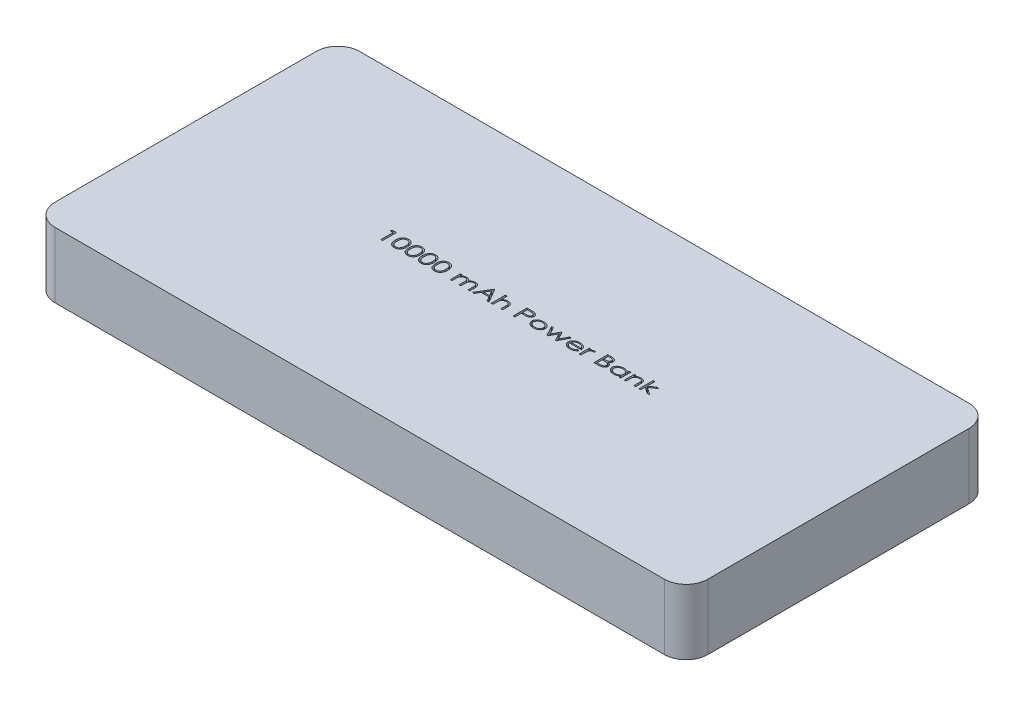
from build123d import *

# Parameters (mm, degrees)
BOSS_EXTRUDE1_DEPTH = 15
CUT_EXTRUDE1_DEPTH  = 5


with BuildPart() as part:
    # Sketch1 → Boss-Extrude1 (new body)
    with BuildSketch(Plane(origin=(0, 0, 0), x_dir=(1, 0, 0), z_dir=(0, 1, 0))):
        with BuildLine():
            Line((-70, -35), (70, -35))
            ThreePointArc((70, -35), (73.535533906, -33.535533906), (75, -30))
            Line((75, -30), (75, 30))
            ThreePointArc((75, 30), (73.535533906, 33.535533906), (70, 35))
            Line((70, 35), (-70, 35))
            ThreePointArc((-70, 35), (-73.535533906, 33.535533906), (-75, 30))
            Line((-75, 30), (-75, -30))
            ThreePointArc((-75, -30), (-73.535533906, -33.535533906), (-70, -35))
        make_face()
    extrude(amount=BOSS_EXTRUDE1_DEPTH)

    # Sketch2 → Cut-Extrude1 (cut)
    # profile 1 of 17: a face of its own
    with BuildSketch(Plane(origin=(0, 15, 0), x_dir=(1, 0, 0), z_dir=(0, 1, 0))):
        Polygon((-30.545382612, 3.175), (-29.735096154, 3.175), (-29.735096154, 0), (-30.142147436, 0), (-30.142147436, 2.849358974), (-30.793429487, 2.849358974), align=None)
    # profile 2 of 17: a face of its own
    with BuildSketch(Plane(origin=(0, 15, 0), x_dir=(1, 0, 0), z_dir=(0, 1, 0))):
        with BuildLine():
            add(Edge.make_bspline(
                [(-28.351121795, 1.586227965), (-28.350727267, 1.637122687), (-28.349960663, 1.736015829), (-28.3413484, 1.880070761), (-28.328382369, 2.015281885), (-28.309956435, 2.141583159), (-28.286863144, 2.258964618), (-28.257484329, 2.367250346), (-28.223607135, 2.46703983), (-28.182961272, 2.557913388), (-28.138023852, 2.641888701), (-28.089258657, 2.7203372), (-28.035260604, 2.793131317), (-27.977759504, 2.861426902), (-27.914943743, 2.923621488), (-27.848852856, 2.981655098), (-27.777022872, 3.032642968), (-27.702285549, 3.080196316), (-27.623356097, 3.120915197), (-27.542632382, 3.157456585), (-27.459386372, 3.188311345), (-27.373570303, 3.212707087), (-27.285729205, 3.232704707), (-27.195626556, 3.246595997), (-27.103210927, 3.255130048), (-27.040732133, 3.255980181), (-27.009124599, 3.256410256)],
                knots=[0, 0, 0, 0, 1.503649737, 2.921730219, 4.262503284, 5.516075274, 6.69178641, 7.795021393, 8.829149449, 9.802301691, 10.73274031, 11.64178177, 12.528843777, 13.408754628, 14.276947477, 15.13851592, 16.004377863, 16.876899079, 17.753928666, 18.625955013, 19.494057458, 20.374325017, 21.26034682, 22.154305278, 23.06627747, 24, 24, 24, 24], degree=3))
            add(Edge.make_bspline(
                [(-27.009124599, 3.256410256), (-26.977092942, 3.255982907), (-26.913767424, 3.255138051), (-26.819879001, 3.246542513), (-26.728282594, 3.232758242), (-26.639139905, 3.212828064), (-26.552168607, 3.188071881), (-26.467551597, 3.157566185), (-26.385151722, 3.121100215), (-26.305338908, 3.079139279), (-26.227965823, 3.032495668), (-26.155623632, 2.978734355), (-26.087334848, 2.919918544), (-26.022546517, 2.856083613), (-25.962410721, 2.786126285), (-25.906210828, 2.710610294), (-25.853922906, 2.629780706), (-25.806238251, 2.542814456), (-25.762289566, 2.449803499), (-25.725946799, 2.348610658), (-25.694032932, 2.240365987), (-25.667918812, 2.124394113), (-25.648758045, 2.000449961), (-25.633885407, 1.869138314), (-25.625960478, 1.730064968), (-25.624584231, 1.634998082), (-25.623878205, 1.586227965)],
                knots=[0, 0, 0, 0, 0.937767327, 1.853934702, 2.758288811, 3.648489533, 4.526834912, 5.404653573, 6.280208139, 7.163258016, 8.043794659, 8.922907602, 9.798968251, 10.681341352, 11.583668834, 12.497519514, 13.43602634, 14.400218243, 15.40010499, 16.445002713, 17.545098876, 18.703307102, 19.92297783, 21.215983973, 22.571776222, 24, 24, 24, 24], degree=3))
            add(Edge.make_bspline(
                [(-25.623878205, 1.586227965), (-25.624212305, 1.537661079), (-25.624863606, 1.442983651), (-25.634394895, 1.304668254), (-25.647789906, 1.17385017), (-25.667532429, 1.050694756), (-25.692685178, 0.935269899), (-25.724198531, 0.827517712), (-25.759593386, 0.72664255), (-25.803074264, 0.634109208), (-25.850106249, 0.547773201), (-25.901899867, 0.467314949), (-25.957931577, 0.392022469), (-26.018330394, 0.322124552), (-26.082699502, 0.257418338), (-26.151847375, 0.198813585), (-26.224972016, 0.14512126), (-26.302470079, 0.097785404), (-26.382929589, 0.055842866), (-26.465475965, 0.018499908), (-26.551038756, -0.011572198), (-26.638194309, -0.037298753), (-26.727656496, -0.057127398), (-26.819485857, -0.070747931), (-26.913520008, -0.080325994), (-26.977087273, -0.081046917), (-27.009124599, -0.081410256)],
                knots=[0, 0, 0, 0, 1.42287291, 2.773781872, 4.060828387, 5.27520363, 6.426792035, 7.519939846, 8.563431598, 9.555755978, 10.512173935, 11.442739076, 12.357218209, 13.260166218, 14.147528077, 15.028911135, 15.913637702, 16.80332344, 17.686980587, 18.571336277, 19.455604679, 20.342248599, 21.23306151, 22.138037539, 23.061587774, 24, 24, 24, 24], degree=3))
            add(Edge.make_bspline(
                [(-27.009124599, -0.081410256), (-27.040731529, -0.080977141), (-27.103209128, -0.080121), (-27.195633497, -0.07163092), (-27.285453808, -0.05761602), (-27.372915106, -0.038351141), (-27.45840577, -0.014626759), (-27.541049702, 0.016289975), (-27.621462397, 0.052125126), (-27.699697358, 0.092307837), (-27.774062105, 0.139079919), (-27.845039956, 0.190436151), (-27.911414402, 0.248121948), (-27.973463228, 0.311045912), (-28.031923529, 0.378725871), (-28.085316364, 0.452365578), (-28.134891933, 0.531155313), (-28.180415615, 0.615810544), (-28.221657553, 0.707315909), (-28.256408176, 0.807624251), (-28.285310726, 0.916574181), (-28.309311395, 1.033814204), (-28.328559297, 1.159662792), (-28.341297876, 1.294298559), (-28.349962805, 1.437498176), (-28.350728493, 1.535756699), (-28.351121795, 1.586227965)],
                knots=[0, 0, 0, 0, 0.934912173, 1.848046295, 2.743143733, 3.622812651, 4.496445533, 5.365654014, 6.230506444, 7.100190045, 7.965178933, 8.827069452, 9.689735607, 10.563481063, 11.439744394, 12.332993909, 13.25184041, 14.191956137, 15.174630498, 16.218062315, 17.328758704, 18.507220368, 19.757112638, 21.093352049, 22.506977365, 24, 24, 24, 24], degree=3))
        make_face()
        with BuildLine():
            add(Edge.make_bspline(
                [(-27.944070513, 1.5875), (-27.943746751, 1.545090497), (-27.94311834, 1.462774897), (-27.937070075, 1.343162178), (-27.928659801, 1.231516596), (-27.915923407, 1.127946603), (-27.899624295, 1.03236406), (-27.879278492, 0.944706965), (-27.856166098, 0.864810886), (-27.828446682, 0.792594864), (-27.796926797, 0.726725766), (-27.762537054, 0.665153896), (-27.724387349, 0.608020001), (-27.682855594, 0.554728919), (-27.637500686, 0.505872325), (-27.589248512, 0.460279301), (-27.536731007, 0.419709778), (-27.463455222, 0.370841324), (-27.367123682, 0.320322293), (-27.246433756, 0.276757337), (-27.122493407, 0.249428664), (-27.038517947, 0.245966863), (-26.996404247, 0.244230769)],
                knots=[0, 0, 0, 0, 1.365459738, 2.650317286, 3.855581839, 4.969875765, 6.009123991, 6.976181044, 7.866094672, 8.685079231, 9.463722796, 10.215633472, 10.954035672, 11.673708734, 12.388704326, 13.098696342, 13.808786807, 14.5225756, 15.933291021, 17.298050938, 18.644972337, 20, 20, 20, 20], degree=3))
            add(Edge.make_bspline(
                [(-26.996404247, 0.244230769), (-26.954068402, 0.2456715), (-26.869846196, 0.248537665), (-26.746529466, 0.27617181), (-26.627100467, 0.318173497), (-26.532744559, 0.367897566), (-26.461156667, 0.415894128), (-26.409674025, 0.456024176), (-26.362279073, 0.501426997), (-26.317649799, 0.55034017), (-26.276346916, 0.603451126), (-26.240110885, 0.661801798), (-26.205022118, 0.723263247), (-26.185735499, 0.767058224), (-26.175941506, 0.789297877)],
                knots=[0, 0, 0, 0, 1.454656591, 2.893868968, 4.32661569, 5.801378547, 6.547894285, 7.290658755, 8.04398565, 8.803046969, 9.567556165, 10.354696976, 11.164493946, 12, 12, 12, 12], degree=3))
            add(Edge.make_bspline(
                [(-26.175941506, 0.789297877), (-26.164413554, 0.817594211), (-26.141071408, 0.874889483), (-26.111019391, 0.964153132), (-26.086547277, 1.057751668), (-26.066082585, 1.155385554), (-26.050341217, 1.257299699), (-26.03874793, 1.363604552), (-26.032697364, 1.474218518), (-26.031525128, 1.549332678), (-26.030929487, 1.5875)],
                knots=[0, 0, 0, 0, 0.897532899, 1.817351705, 2.764618306, 3.738200912, 4.746854777, 5.793041112, 6.878590785, 8, 8, 8, 8], degree=3))
            add(Edge.make_bspline(
                [(-26.030929487, 1.5875), (-26.03122034, 1.625671311), (-26.03178955, 1.700373952), (-26.038432976, 1.809631559), (-26.048428763, 1.91361748), (-26.062446693, 2.01229239), (-26.079824797, 2.105846441), (-26.102385643, 2.193854831), (-26.128087479, 2.276912564), (-26.158957455, 2.354392921), (-26.192262845, 2.427067662), (-26.229725839, 2.494011222), (-26.268709423, 2.55691452), (-26.312281325, 2.613872098), (-26.358015093, 2.666765575), (-26.407835323, 2.713543427), (-26.46010066, 2.756036507), (-26.53351305, 2.804429379), (-26.62926203, 2.854523345), (-26.74849038, 2.899158376), (-26.871674565, 2.925332859), (-26.954731841, 2.928952929), (-26.996404247, 2.930769231)],
                knots=[0, 0, 0, 0, 1.229525781, 2.406226545, 3.524826222, 4.594047567, 5.616071261, 6.588417605, 7.519395492, 8.41479633, 9.273418453, 10.092675396, 10.884690884, 11.655091559, 12.400379745, 13.134697013, 13.85360731, 14.56773274, 15.963844624, 17.325176792, 18.657958416, 20, 20, 20, 20], degree=3))
            add(Edge.make_bspline(
                [(-26.996404247, 2.930769231), (-27.038924859, 2.928974418), (-27.123247564, 2.925415123), (-27.247923826, 2.899248481), (-27.367845453, 2.854674744), (-27.463478269, 2.804537197), (-27.536324038, 2.756646036), (-27.587955294, 2.715714696), (-27.636330587, 2.670687586), (-27.680794331, 2.621061406), (-27.723359694, 2.568734578), (-27.760344663, 2.510676255), (-27.795899475, 2.449804247), (-27.826944113, 2.383491411), (-27.85576379, 2.311635802), (-27.878451334, 2.231721477), (-27.899228389, 2.144170692), (-27.9150465, 2.048260969), (-27.928834478, 1.944595692), (-27.937057099, 1.832680341), (-27.943126966, 1.712862602), (-27.943749716, 1.630122086), (-27.944070513, 1.5875)],
                knots=[0, 0, 0, 0, 1.368599115, 2.714071407, 4.081120454, 5.476525329, 6.180825298, 6.88552213, 7.595489274, 8.305850116, 9.029726763, 9.764338507, 10.519592943, 11.298209231, 12.119636502, 13.009518955, 13.969893518, 15.015831986, 16.137713852, 17.336131509, 18.62776257, 20, 20, 20, 20], degree=3))
        make_face(mode=Mode.SUBTRACT)
    # profile 3 of 17: a face of its own
    with BuildSketch(Plane(origin=(0, 15, 0), x_dir=(1, 0, 0), z_dir=(0, 1, 0))):
        with BuildLine():
            add(Edge.make_bspline(
                [(-25.257532051, 1.586227965), (-25.257137524, 1.637122687), (-25.25637092, 1.736015829), (-25.247758657, 1.880070761), (-25.234792625, 2.015281885), (-25.216366692, 2.141583159), (-25.1932734, 2.258964618), (-25.163894586, 2.367250346), (-25.130017391, 2.46703983), (-25.089371528, 2.557913388), (-25.044434108, 2.641888701), (-24.995668914, 2.7203372), (-24.94167086, 2.793131317), (-24.88416976, 2.861426902), (-24.821353999, 2.923621488), (-24.755263113, 2.981655098), (-24.683433129, 3.032642968), (-24.608695805, 3.080196316), (-24.529766353, 3.120915197), (-24.449042638, 3.157456585), (-24.365796628, 3.188311345), (-24.279980559, 3.212707087), (-24.192139461, 3.232704707), (-24.102036812, 3.246595997), (-24.009621183, 3.255130048), (-23.947142389, 3.255980181), (-23.915534856, 3.256410256)],
                knots=[0, 0, 0, 0, 1.503649737, 2.921730219, 4.262503284, 5.516075274, 6.69178641, 7.795021393, 8.829149449, 9.802301691, 10.73274031, 11.64178177, 12.528843777, 13.408754628, 14.276947477, 15.13851592, 16.004377863, 16.876899079, 17.753928666, 18.625955013, 19.494057458, 20.374325017, 21.26034682, 22.154305278, 23.06627747, 24, 24, 24, 24], degree=3))
            add(Edge.make_bspline(
                [(-23.915534856, 3.256410256), (-23.883503198, 3.255982907), (-23.82017768, 3.255138051), (-23.726289257, 3.246542513), (-23.63469285, 3.232758242), (-23.545550161, 3.212828064), (-23.458578864, 3.188071881), (-23.373961853, 3.157566185), (-23.291561978, 3.121100215), (-23.211749165, 3.079139279), (-23.134376079, 3.032495668), (-23.062033888, 2.978734355), (-22.993745105, 2.919918544), (-22.928956774, 2.856083613), (-22.868820977, 2.786126285), (-22.812621084, 2.710610294), (-22.760333162, 2.629780706), (-22.712648507, 2.542814456), (-22.668699822, 2.449803499), (-22.632357056, 2.348610658), (-22.600443188, 2.240365987), (-22.574329069, 2.124394113), (-22.555168301, 2.000449961), (-22.540295663, 1.869138314), (-22.532370735, 1.730064968), (-22.530994488, 1.634998082), (-22.530288462, 1.586227965)],
                knots=[0, 0, 0, 0, 0.937767327, 1.853934702, 2.758288811, 3.648489533, 4.526834912, 5.404653573, 6.280208139, 7.163258016, 8.043794659, 8.922907602, 9.798968251, 10.681341352, 11.583668834, 12.497519514, 13.43602634, 14.400218243, 15.40010499, 16.445002713, 17.545098876, 18.703307102, 19.92297783, 21.215983973, 22.571776222, 24, 24, 24, 24], degree=3))
            add(Edge.make_bspline(
                [(-22.530288462, 1.586227965), (-22.530622561, 1.537661079), (-22.531273862, 1.442983651), (-22.540805151, 1.304668254), (-22.554200163, 1.17385017), (-22.573942685, 1.050694756), (-22.599095434, 0.935269899), (-22.630608787, 0.827517712), (-22.666003643, 0.72664255), (-22.70948452, 0.634109208), (-22.756516505, 0.547773201), (-22.808310124, 0.467314949), (-22.864341834, 0.392022469), (-22.924740651, 0.322124552), (-22.989109758, 0.257418338), (-23.058257632, 0.198813585), (-23.131382272, 0.14512126), (-23.208880335, 0.097785404), (-23.289339846, 0.055842866), (-23.371886221, 0.018499908), (-23.457449013, -0.011572198), (-23.544604566, -0.037298753), (-23.634066752, -0.057127398), (-23.725896113, -0.070747931), (-23.819930264, -0.080325994), (-23.88349753, -0.081046917), (-23.915534856, -0.081410256)],
                knots=[0, 0, 0, 0, 1.42287291, 2.773781872, 4.060828387, 5.27520363, 6.426792035, 7.519939846, 8.563431598, 9.555755978, 10.512173935, 11.442739076, 12.357218209, 13.260166218, 14.147528077, 15.028911135, 15.913637702, 16.80332344, 17.686980587, 18.571336277, 19.455604679, 20.342248599, 21.23306151, 22.138037539, 23.061587774, 24, 24, 24, 24], degree=3))
            add(Edge.make_bspline(
                [(-23.915534856, -0.081410256), (-23.947141785, -0.080977141), (-24.009619385, -0.080121), (-24.102043754, -0.07163092), (-24.191864065, -0.05761602), (-24.279325363, -0.038351141), (-24.364816027, -0.014626759), (-24.447459958, 0.016289975), (-24.527872653, 0.052125126), (-24.606107614, 0.092307837), (-24.680472361, 0.139079919), (-24.751450212, 0.190436151), (-24.817824658, 0.248121948), (-24.879873485, 0.311045912), (-24.938333785, 0.378725871), (-24.99172662, 0.452365578), (-25.04130219, 0.531155313), (-25.086825872, 0.615810544), (-25.128067809, 0.707315909), (-25.162818433, 0.807624251), (-25.191720983, 0.916574181), (-25.215721651, 1.033814204), (-25.234969554, 1.159662792), (-25.247708132, 1.294298559), (-25.256373062, 1.437498176), (-25.25713875, 1.535756699), (-25.257532051, 1.586227965)],
                knots=[0, 0, 0, 0, 0.934912173, 1.848046295, 2.743143733, 3.622812651, 4.496445533, 5.365654014, 6.230506444, 7.100190045, 7.965178933, 8.827069452, 9.689735607, 10.563481063, 11.439744394, 12.332993909, 13.25184041, 14.191956137, 15.174630498, 16.218062315, 17.328758704, 18.507220368, 19.757112638, 21.093352049, 22.506977365, 24, 24, 24, 24], degree=3))
        make_face()
        with BuildLine():
            add(Edge.make_bspline(
                [(-24.850480769, 1.5875), (-24.850157008, 1.545090497), (-24.849528596, 1.462774897), (-24.843480331, 1.343162178), (-24.835070057, 1.231516596), (-24.822333663, 1.127946603), (-24.806034551, 1.03236406), (-24.785688749, 0.944706965), (-24.762576354, 0.864810886), (-24.734856938, 0.792594864), (-24.703337054, 0.726725766), (-24.66894731, 0.665153896), (-24.630797605, 0.608020001), (-24.589265851, 0.554728919), (-24.543910943, 0.505872325), (-24.495658769, 0.460279301), (-24.443141263, 0.419709778), (-24.369865478, 0.370841324), (-24.273533938, 0.320322293), (-24.152844013, 0.276757337), (-24.028903664, 0.249428664), (-23.944928203, 0.245966863), (-23.902814503, 0.244230769)],
                knots=[0, 0, 0, 0, 1.365459738, 2.650317286, 3.855581839, 4.969875765, 6.009123991, 6.976181044, 7.866094672, 8.685079231, 9.463722796, 10.215633472, 10.954035672, 11.673708734, 12.388704326, 13.098696342, 13.808786807, 14.5225756, 15.933291021, 17.298050938, 18.644972337, 20, 20, 20, 20], degree=3))
            add(Edge.make_bspline(
                [(-23.902814503, 0.244230769), (-23.860478658, 0.2456715), (-23.776256452, 0.248537665), (-23.652939722, 0.27617181), (-23.533510723, 0.318173497), (-23.439154815, 0.367897566), (-23.367566923, 0.415894128), (-23.316084281, 0.456024176), (-23.268689329, 0.501426997), (-23.224060055, 0.55034017), (-23.182757172, 0.603451126), (-23.146521141, 0.661801798), (-23.111432374, 0.723263247), (-23.092145756, 0.767058224), (-23.082351763, 0.789297877)],
                knots=[0, 0, 0, 0, 1.454656591, 2.893868968, 4.32661569, 5.801378547, 6.547894285, 7.290658755, 8.04398565, 8.803046969, 9.567556165, 10.354696976, 11.164493946, 12, 12, 12, 12], degree=3))
            add(Edge.make_bspline(
                [(-23.082351763, 0.789297877), (-23.070823811, 0.817594211), (-23.047481665, 0.874889483), (-23.017429647, 0.964153132), (-22.992957534, 1.057751668), (-22.972492841, 1.155385554), (-22.956751473, 1.257299699), (-22.945158187, 1.363604552), (-22.93910762, 1.474218518), (-22.937935385, 1.549332678), (-22.937339744, 1.5875)],
                knots=[0, 0, 0, 0, 0.897532899, 1.817351705, 2.764618306, 3.738200912, 4.746854777, 5.793041112, 6.878590785, 8, 8, 8, 8], degree=3))
            add(Edge.make_bspline(
                [(-22.937339744, 1.5875), (-22.937630597, 1.625671311), (-22.938199806, 1.700373952), (-22.944843232, 1.809631559), (-22.954839019, 1.91361748), (-22.968856949, 2.01229239), (-22.986235054, 2.105846441), (-23.0087959, 2.193854831), (-23.034497736, 2.276912564), (-23.065367711, 2.354392921), (-23.098673102, 2.427067662), (-23.136136095, 2.494011222), (-23.175119679, 2.55691452), (-23.218691582, 2.613872098), (-23.26442535, 2.666765575), (-23.31424558, 2.713543427), (-23.366510917, 2.756036507), (-23.439923307, 2.804429379), (-23.535672287, 2.854523345), (-23.654900636, 2.899158376), (-23.778084821, 2.925332859), (-23.861142097, 2.928952929), (-23.902814503, 2.930769231)],
                knots=[0, 0, 0, 0, 1.229525781, 2.406226545, 3.524826222, 4.594047567, 5.616071261, 6.588417605, 7.519395492, 8.41479633, 9.273418453, 10.092675396, 10.884690884, 11.655091559, 12.400379745, 13.134697013, 13.85360731, 14.56773274, 15.963844624, 17.325176792, 18.657958416, 20, 20, 20, 20], degree=3))
            add(Edge.make_bspline(
                [(-23.902814503, 2.930769231), (-23.945335116, 2.928974418), (-24.02965782, 2.925415123), (-24.154334083, 2.899248481), (-24.27425571, 2.854674744), (-24.369888525, 2.804537197), (-24.442734294, 2.756646036), (-24.49436555, 2.715714696), (-24.542740843, 2.670687586), (-24.587204587, 2.621061406), (-24.62976995, 2.568734578), (-24.666754919, 2.510676255), (-24.702309732, 2.449804247), (-24.73335437, 2.383491411), (-24.762174046, 2.311635802), (-24.78486159, 2.231721477), (-24.805638646, 2.144170692), (-24.821456756, 2.048260969), (-24.835244734, 1.944595692), (-24.843467355, 1.832680341), (-24.849537222, 1.712862602), (-24.850159972, 1.630122086), (-24.850480769, 1.5875)],
                knots=[0, 0, 0, 0, 1.368599115, 2.714071407, 4.081120454, 5.476525329, 6.180825298, 6.88552213, 7.595489274, 8.305850116, 9.029726763, 9.764338507, 10.519592943, 11.298209231, 12.119636502, 13.009518955, 13.969893518, 15.015831986, 16.137713852, 17.336131509, 18.62776257, 20, 20, 20, 20], degree=3))
        make_face(mode=Mode.SUBTRACT)
    # profile 4 of 17: a face of its own
    with BuildSketch(Plane(origin=(0, 15, 0), x_dir=(1, 0, 0), z_dir=(0, 1, 0))):
        with BuildLine():
            add(Edge.make_bspline(
                [(-22.163942308, 1.586227965), (-22.16354778, 1.637122687), (-22.162781176, 1.736015829), (-22.154168913, 1.880070761), (-22.141202881, 2.015281885), (-22.122776948, 2.141583159), (-22.099683657, 2.258964618), (-22.070304842, 2.367250346), (-22.036427648, 2.46703983), (-21.995781785, 2.557913388), (-21.950844365, 2.641888701), (-21.90207917, 2.7203372), (-21.848081117, 2.793131317), (-21.790580016, 2.861426902), (-21.727764256, 2.923621488), (-21.661673369, 2.981655098), (-21.589843385, 3.032642968), (-21.515106062, 3.080196316), (-21.436176609, 3.120915197), (-21.355452894, 3.157456585), (-21.272206884, 3.188311345), (-21.186390816, 3.212707087), (-21.098549718, 3.232704707), (-21.008447068, 3.246595997), (-20.91603144, 3.255130048), (-20.853552646, 3.255980181), (-20.821945112, 3.256410256)],
                knots=[0, 0, 0, 0, 1.503649737, 2.921730219, 4.262503284, 5.516075274, 6.69178641, 7.795021393, 8.829149449, 9.802301691, 10.73274031, 11.64178177, 12.528843777, 13.408754628, 14.276947477, 15.13851592, 16.004377863, 16.876899079, 17.753928666, 18.625955013, 19.494057458, 20.374325017, 21.26034682, 22.154305278, 23.06627747, 24, 24, 24, 24], degree=3))
            add(Edge.make_bspline(
                [(-20.821945112, 3.256410256), (-20.789913454, 3.255982907), (-20.726587936, 3.255138051), (-20.632699513, 3.246542513), (-20.541103107, 3.232758242), (-20.451960417, 3.212828064), (-20.36498912, 3.188071881), (-20.28037211, 3.157566185), (-20.197972234, 3.121100215), (-20.118159421, 3.079139279), (-20.040786335, 3.032495668), (-19.968444145, 2.978734355), (-19.900155361, 2.919918544), (-19.83536703, 2.856083613), (-19.775231234, 2.786126285), (-19.719031341, 2.710610294), (-19.666743419, 2.629780706), (-19.619058764, 2.542814456), (-19.575110079, 2.449803499), (-19.538767312, 2.348610658), (-19.506853445, 2.240365987), (-19.480739325, 2.124394113), (-19.461578558, 2.000449961), (-19.446705919, 1.869138314), (-19.438780991, 1.730064968), (-19.437404744, 1.634998082), (-19.436698718, 1.586227965)],
                knots=[0, 0, 0, 0, 0.937767327, 1.853934702, 2.758288811, 3.648489533, 4.526834912, 5.404653573, 6.280208139, 7.163258016, 8.043794659, 8.922907602, 9.798968251, 10.681341352, 11.583668834, 12.497519514, 13.43602634, 14.400218243, 15.40010499, 16.445002713, 17.545098876, 18.703307102, 19.92297783, 21.215983973, 22.571776222, 24, 24, 24, 24], degree=3))
            add(Edge.make_bspline(
                [(-19.436698718, 1.586227965), (-19.437032817, 1.537661079), (-19.437684119, 1.442983651), (-19.447215408, 1.304668254), (-19.460610419, 1.17385017), (-19.480352942, 1.050694756), (-19.50550569, 0.935269899), (-19.537019044, 0.827517712), (-19.572413899, 0.72664255), (-19.615894777, 0.634109208), (-19.662926762, 0.547773201), (-19.71472038, 0.467314949), (-19.77075209, 0.392022469), (-19.831150907, 0.322124552), (-19.895520014, 0.257418338), (-19.964667888, 0.198813585), (-20.037792529, 0.14512126), (-20.115290591, 0.097785404), (-20.195750102, 0.055842866), (-20.278296478, 0.018499908), (-20.363859269, -0.011572198), (-20.451014822, -0.037298753), (-20.540477009, -0.057127398), (-20.632306369, -0.070747931), (-20.726340521, -0.080325994), (-20.789907786, -0.081046917), (-20.821945112, -0.081410256)],
                knots=[0, 0, 0, 0, 1.42287291, 2.773781872, 4.060828387, 5.27520363, 6.426792035, 7.519939846, 8.563431598, 9.555755978, 10.512173935, 11.442739076, 12.357218209, 13.260166218, 14.147528077, 15.028911135, 15.913637702, 16.80332344, 17.686980587, 18.571336277, 19.455604679, 20.342248599, 21.23306151, 22.138037539, 23.061587774, 24, 24, 24, 24], degree=3))
            add(Edge.make_bspline(
                [(-20.821945112, -0.081410256), (-20.853552041, -0.080977141), (-20.916029641, -0.080121), (-21.00845401, -0.07163092), (-21.098274321, -0.05761602), (-21.185735619, -0.038351141), (-21.271226283, -0.014626759), (-21.353870214, 0.016289975), (-21.43428291, 0.052125126), (-21.51251787, 0.092307837), (-21.586882618, 0.139079919), (-21.657860468, 0.190436151), (-21.724234915, 0.248121948), (-21.786283741, 0.311045912), (-21.844744042, 0.378725871), (-21.898136876, 0.452365578), (-21.947712446, 0.531155313), (-21.993236128, 0.615810544), (-22.034478066, 0.707315909), (-22.069228689, 0.807624251), (-22.098131239, 0.916574181), (-22.122131907, 1.033814204), (-22.14137981, 1.159662792), (-22.154118389, 1.294298559), (-22.162783318, 1.437498176), (-22.163549006, 1.535756699), (-22.163942308, 1.586227965)],
                knots=[0, 0, 0, 0, 0.934912173, 1.848046295, 2.743143733, 3.622812651, 4.496445533, 5.365654014, 6.230506444, 7.100190045, 7.965178933, 8.827069452, 9.689735607, 10.563481063, 11.439744394, 12.332993909, 13.25184041, 14.191956137, 15.174630498, 16.218062315, 17.328758704, 18.507220368, 19.757112638, 21.093352049, 22.506977365, 24, 24, 24, 24], degree=3))
        make_face()
        with BuildLine():
            add(Edge.make_bspline(
                [(-21.756891026, 1.5875), (-21.756567264, 1.545090497), (-21.755938853, 1.462774897), (-21.749890588, 1.343162178), (-21.741480314, 1.231516596), (-21.72874392, 1.127946603), (-21.712444808, 1.03236406), (-21.692099005, 0.944706965), (-21.66898661, 0.864810886), (-21.641267195, 0.792594864), (-21.60974731, 0.726725766), (-21.575357567, 0.665153896), (-21.537207862, 0.608020001), (-21.495676107, 0.554728919), (-21.450321199, 0.505872325), (-21.402069025, 0.460279301), (-21.34955152, 0.419709778), (-21.276275735, 0.370841324), (-21.179944195, 0.320322293), (-21.059254269, 0.276757337), (-20.93531392, 0.249428664), (-20.85133846, 0.245966863), (-20.80922476, 0.244230769)],
                knots=[0, 0, 0, 0, 1.365459738, 2.650317286, 3.855581839, 4.969875765, 6.009123991, 6.976181044, 7.866094672, 8.685079231, 9.463722796, 10.215633472, 10.954035672, 11.673708734, 12.388704326, 13.098696342, 13.808786807, 14.5225756, 15.933291021, 17.298050938, 18.644972337, 20, 20, 20, 20], degree=3))
            add(Edge.make_bspline(
                [(-20.80922476, 0.244230769), (-20.766888915, 0.2456715), (-20.682666709, 0.248537665), (-20.559349979, 0.27617181), (-20.43992098, 0.318173497), (-20.345565072, 0.367897566), (-20.273977179, 0.415894128), (-20.222494538, 0.456024176), (-20.175099586, 0.501426997), (-20.130470312, 0.55034017), (-20.089167429, 0.603451126), (-20.052931398, 0.661801798), (-20.01784263, 0.723263247), (-19.998556012, 0.767058224), (-19.988762019, 0.789297877)],
                knots=[0, 0, 0, 0, 1.454656591, 2.893868968, 4.32661569, 5.801378547, 6.547894285, 7.290658755, 8.04398565, 8.803046969, 9.567556165, 10.354696976, 11.164493946, 12, 12, 12, 12], degree=3))
            add(Edge.make_bspline(
                [(-19.988762019, 0.789297877), (-19.977234067, 0.817594211), (-19.953891921, 0.874889483), (-19.923839904, 0.964153132), (-19.89936779, 1.057751668), (-19.878903098, 1.155385554), (-19.86316173, 1.257299699), (-19.851568443, 1.363604552), (-19.845517877, 1.474218518), (-19.844345641, 1.549332678), (-19.84375, 1.5875)],
                knots=[0, 0, 0, 0, 0.897532899, 1.817351705, 2.764618306, 3.738200912, 4.746854777, 5.793041112, 6.878590785, 8, 8, 8, 8], degree=3))
            add(Edge.make_bspline(
                [(-19.84375, 1.5875), (-19.844040853, 1.625671311), (-19.844610063, 1.700373952), (-19.851253489, 1.809631559), (-19.861249276, 1.91361748), (-19.875267206, 2.01229239), (-19.89264531, 2.105846441), (-19.915206156, 2.193854831), (-19.940907992, 2.276912564), (-19.971777968, 2.354392921), (-20.005083358, 2.427067662), (-20.042546352, 2.494011222), (-20.081529936, 2.55691452), (-20.125101838, 2.613872098), (-20.170835606, 2.666765575), (-20.220655836, 2.713543427), (-20.272921173, 2.756036507), (-20.346333563, 2.804429379), (-20.442082543, 2.854523345), (-20.561310892, 2.899158376), (-20.684495078, 2.925332859), (-20.767552354, 2.928952929), (-20.80922476, 2.930769231)],
                knots=[0, 0, 0, 0, 1.229525781, 2.406226545, 3.524826222, 4.594047567, 5.616071261, 6.588417605, 7.519395492, 8.41479633, 9.273418453, 10.092675396, 10.884690884, 11.655091559, 12.400379745, 13.134697013, 13.85360731, 14.56773274, 15.963844624, 17.325176792, 18.657958416, 20, 20, 20, 20], degree=3))
            add(Edge.make_bspline(
                [(-20.80922476, 2.930769231), (-20.851745372, 2.928974418), (-20.936068077, 2.925415123), (-21.060744339, 2.899248481), (-21.180665966, 2.854674744), (-21.276298781, 2.804537197), (-21.349144551, 2.756646036), (-21.400775807, 2.715714696), (-21.449151099, 2.670687586), (-21.493614844, 2.621061406), (-21.536180207, 2.568734578), (-21.573165176, 2.510676255), (-21.608719988, 2.449804247), (-21.639764626, 2.383491411), (-21.668584303, 2.311635802), (-21.691271847, 2.231721477), (-21.712048902, 2.144170692), (-21.727867013, 2.048260969), (-21.74165499, 1.944595692), (-21.749877612, 1.832680341), (-21.755947479, 1.712862602), (-21.756570229, 1.630122086), (-21.756891026, 1.5875)],
                knots=[0, 0, 0, 0, 1.368599115, 2.714071407, 4.081120454, 5.476525329, 6.180825298, 6.88552213, 7.595489274, 8.305850116, 9.029726763, 9.764338507, 10.519592943, 11.298209231, 12.119636502, 13.009518955, 13.969893518, 15.015831986, 16.137713852, 17.336131509, 18.62776257, 20, 20, 20, 20], degree=3))
        make_face(mode=Mode.SUBTRACT)
    # profile 5 of 17: a face of its own
    with BuildSketch(Plane(origin=(0, 15, 0), x_dir=(1, 0, 0), z_dir=(0, 1, 0))):
        with BuildLine():
            add(Edge.make_bspline(
                [(-19.070352564, 1.586227965), (-19.069958036, 1.637122687), (-19.069191433, 1.736015829), (-19.060579169, 1.880070761), (-19.047613138, 2.015281885), (-19.029187205, 2.141583159), (-19.006093913, 2.258964618), (-18.976715099, 2.367250346), (-18.942837904, 2.46703983), (-18.902192041, 2.557913388), (-18.857254621, 2.641888701), (-18.808489426, 2.7203372), (-18.754491373, 2.793131317), (-18.696990273, 2.861426902), (-18.634174512, 2.923621488), (-18.568083626, 2.981655098), (-18.496253642, 3.032642968), (-18.421516318, 3.080196316), (-18.342586866, 3.120915197), (-18.261863151, 3.157456585), (-18.178617141, 3.188311345), (-18.092801072, 3.212707087), (-18.004959974, 3.232704707), (-17.914857325, 3.246595997), (-17.822441696, 3.255130048), (-17.759962902, 3.255980181), (-17.728355369, 3.256410256)],
                knots=[0, 0, 0, 0, 1.503649737, 2.921730219, 4.262503284, 5.516075274, 6.69178641, 7.795021393, 8.829149449, 9.802301691, 10.73274031, 11.64178177, 12.528843777, 13.408754628, 14.276947477, 15.13851592, 16.004377863, 16.876899079, 17.753928666, 18.625955013, 19.494057458, 20.374325017, 21.26034682, 22.154305278, 23.06627747, 24, 24, 24, 24], degree=3))
            add(Edge.make_bspline(
                [(-17.728355369, 3.256410256), (-17.696323711, 3.255982907), (-17.632998193, 3.255138051), (-17.53910977, 3.246542513), (-17.447513363, 3.232758242), (-17.358370674, 3.212828064), (-17.271399376, 3.188071881), (-17.186782366, 3.157566185), (-17.104382491, 3.121100215), (-17.024569678, 3.079139279), (-16.947196592, 3.032495668), (-16.874854401, 2.978734355), (-16.806565618, 2.919918544), (-16.741777287, 2.856083613), (-16.68164149, 2.786126285), (-16.625441597, 2.710610294), (-16.573153675, 2.629780706), (-16.52546902, 2.542814456), (-16.481520335, 2.449803499), (-16.445177568, 2.348610658), (-16.413263701, 2.240365987), (-16.387149582, 2.124394113), (-16.367988814, 2.000449961), (-16.353116176, 1.869138314), (-16.345191247, 1.730064968), (-16.343815001, 1.634998082), (-16.343108974, 1.586227965)],
                knots=[0, 0, 0, 0, 0.937767327, 1.853934702, 2.758288811, 3.648489533, 4.526834912, 5.404653573, 6.280208139, 7.163258016, 8.043794659, 8.922907602, 9.798968251, 10.681341352, 11.583668834, 12.497519514, 13.43602634, 14.400218243, 15.40010499, 16.445002713, 17.545098876, 18.703307102, 19.92297783, 21.215983973, 22.571776222, 24, 24, 24, 24], degree=3))
            add(Edge.make_bspline(
                [(-16.343108974, 1.586227965), (-16.343443074, 1.537661079), (-16.344094375, 1.442983651), (-16.353625664, 1.304668254), (-16.367020676, 1.17385017), (-16.386763198, 1.050694756), (-16.411915947, 0.935269899), (-16.4434293, 0.827517712), (-16.478824155, 0.72664255), (-16.522305033, 0.634109208), (-16.569337018, 0.547773201), (-16.621130637, 0.467314949), (-16.677162347, 0.392022469), (-16.737561164, 0.322124552), (-16.801930271, 0.257418338), (-16.871078144, 0.198813585), (-16.944202785, 0.14512126), (-17.021700848, 0.097785404), (-17.102160359, 0.055842866), (-17.184706734, 0.018499908), (-17.270269525, -0.011572198), (-17.357425078, -0.037298753), (-17.446887265, -0.057127398), (-17.538716626, -0.070747931), (-17.632750777, -0.080325994), (-17.696318042, -0.081046917), (-17.728355369, -0.081410256)],
                knots=[0, 0, 0, 0, 1.42287291, 2.773781872, 4.060828387, 5.27520363, 6.426792035, 7.519939846, 8.563431598, 9.555755978, 10.512173935, 11.442739076, 12.357218209, 13.260166218, 14.147528077, 15.028911135, 15.913637702, 16.80332344, 17.686980587, 18.571336277, 19.455604679, 20.342248599, 21.23306151, 22.138037539, 23.061587774, 24, 24, 24, 24], degree=3))
            add(Edge.make_bspline(
                [(-17.728355369, -0.081410256), (-17.759962298, -0.080977141), (-17.822439897, -0.080121), (-17.914864267, -0.07163092), (-18.004684578, -0.05761602), (-18.092145876, -0.038351141), (-18.17763654, -0.014626759), (-18.260280471, 0.016289975), (-18.340693166, 0.052125126), (-18.418928127, 0.092307837), (-18.493292874, 0.139079919), (-18.564270725, 0.190436151), (-18.630645171, 0.248121948), (-18.692693998, 0.311045912), (-18.751154298, 0.378725871), (-18.804547133, 0.452365578), (-18.854122703, 0.531155313), (-18.899646384, 0.615810544), (-18.940888322, 0.707315909), (-18.975638946, 0.807624251), (-19.004541495, 0.916574181), (-19.028542164, 1.033814204), (-19.047790066, 1.159662792), (-19.060528645, 1.294298559), (-19.069193574, 1.437498176), (-19.069959262, 1.535756699), (-19.070352564, 1.586227965)],
                knots=[0, 0, 0, 0, 0.934912173, 1.848046295, 2.743143733, 3.622812651, 4.496445533, 5.365654014, 6.230506444, 7.100190045, 7.965178933, 8.827069452, 9.689735607, 10.563481063, 11.439744394, 12.332993909, 13.25184041, 14.191956137, 15.174630498, 16.218062315, 17.328758704, 18.507220368, 19.757112638, 21.093352049, 22.506977365, 24, 24, 24, 24], degree=3))
        make_face()
        with BuildLine():
            add(Edge.make_bspline(
                [(-18.663301282, 1.5875), (-18.662977521, 1.545090497), (-18.662349109, 1.462774897), (-18.656300844, 1.343162178), (-18.64789057, 1.231516596), (-18.635154176, 1.127946603), (-18.618855064, 1.03236406), (-18.598509261, 0.944706965), (-18.575396867, 0.864810886), (-18.547677451, 0.792594864), (-18.516157567, 0.726725766), (-18.481767823, 0.665153896), (-18.443618118, 0.608020001), (-18.402086364, 0.554728919), (-18.356731455, 0.505872325), (-18.308479282, 0.460279301), (-18.255961776, 0.419709778), (-18.182685991, 0.370841324), (-18.086354451, 0.320322293), (-17.965664525, 0.276757337), (-17.841724177, 0.249428664), (-17.757748716, 0.245966863), (-17.715635016, 0.244230769)],
                knots=[0, 0, 0, 0, 1.365459738, 2.650317286, 3.855581839, 4.969875765, 6.009123991, 6.976181044, 7.866094672, 8.685079231, 9.463722796, 10.215633472, 10.954035672, 11.673708734, 12.388704326, 13.098696342, 13.808786807, 14.5225756, 15.933291021, 17.298050938, 18.644972337, 20, 20, 20, 20], degree=3))
            add(Edge.make_bspline(
                [(-17.715635016, 0.244230769), (-17.673299171, 0.2456715), (-17.589076965, 0.248537665), (-17.465760235, 0.27617181), (-17.346331236, 0.318173497), (-17.251975328, 0.367897566), (-17.180387436, 0.415894128), (-17.128904794, 0.456024176), (-17.081509842, 0.501426997), (-17.036880568, 0.55034017), (-16.995577685, 0.603451126), (-16.959341654, 0.661801798), (-16.924252887, 0.723263247), (-16.904966269, 0.767058224), (-16.895172276, 0.789297877)],
                knots=[0, 0, 0, 0, 1.454656591, 2.893868968, 4.32661569, 5.801378547, 6.547894285, 7.290658755, 8.04398565, 8.803046969, 9.567556165, 10.354696976, 11.164493946, 12, 12, 12, 12], degree=3))
            add(Edge.make_bspline(
                [(-16.895172276, 0.789297877), (-16.883644323, 0.817594211), (-16.860302178, 0.874889483), (-16.83025016, 0.964153132), (-16.805778046, 1.057751668), (-16.785313354, 1.155385554), (-16.769571986, 1.257299699), (-16.7579787, 1.363604552), (-16.751928133, 1.474218518), (-16.750755898, 1.549332678), (-16.750160256, 1.5875)],
                knots=[0, 0, 0, 0, 0.897532899, 1.817351705, 2.764618306, 3.738200912, 4.746854777, 5.793041112, 6.878590785, 8, 8, 8, 8], degree=3))
            add(Edge.make_bspline(
                [(-16.750160256, 1.5875), (-16.750451109, 1.625671311), (-16.751020319, 1.700373952), (-16.757663745, 1.809631559), (-16.767659532, 1.91361748), (-16.781677462, 2.01229239), (-16.799055566, 2.105846441), (-16.821616412, 2.193854831), (-16.847318248, 2.276912564), (-16.878188224, 2.354392921), (-16.911493614, 2.427067662), (-16.948956608, 2.494011222), (-16.987940192, 2.55691452), (-17.031512095, 2.613872098), (-17.077245862, 2.666765575), (-17.127066093, 2.713543427), (-17.17933143, 2.756036507), (-17.252743819, 2.804429379), (-17.3484928, 2.854523345), (-17.467721149, 2.899158376), (-17.590905334, 2.925332859), (-17.67396261, 2.928952929), (-17.715635016, 2.930769231)],
                knots=[0, 0, 0, 0, 1.229525781, 2.406226545, 3.524826222, 4.594047567, 5.616071261, 6.588417605, 7.519395492, 8.41479633, 9.273418453, 10.092675396, 10.884690884, 11.655091559, 12.400379745, 13.134697013, 13.85360731, 14.56773274, 15.963844624, 17.325176792, 18.657958416, 20, 20, 20, 20], degree=3))
            add(Edge.make_bspline(
                [(-17.715635016, 2.930769231), (-17.758155629, 2.928974418), (-17.842478333, 2.925415123), (-17.967154596, 2.899248481), (-18.087076223, 2.854674744), (-18.182709038, 2.804537197), (-18.255554807, 2.756646036), (-18.307186063, 2.715714696), (-18.355561356, 2.670687586), (-18.4000251, 2.621061406), (-18.442590463, 2.568734578), (-18.479575432, 2.510676255), (-18.515130244, 2.449804247), (-18.546174883, 2.383491411), (-18.574994559, 2.311635802), (-18.597682103, 2.231721477), (-18.618459159, 2.144170692), (-18.634277269, 2.048260969), (-18.648065247, 1.944595692), (-18.656287868, 1.832680341), (-18.662357735, 1.712862602), (-18.662980485, 1.630122086), (-18.663301282, 1.5875)],
                knots=[0, 0, 0, 0, 1.368599115, 2.714071407, 4.081120454, 5.476525329, 6.180825298, 6.88552213, 7.595489274, 8.305850116, 9.029726763, 9.764338507, 10.519592943, 11.298209231, 12.119636502, 13.009518955, 13.969893518, 15.015831986, 16.137713852, 17.336131509, 18.62776257, 20, 20, 20, 20], degree=3))
        make_face(mode=Mode.SUBTRACT)
    # profile 6 of 17: a face of its own
    with BuildSketch(Plane(origin=(0, 15, 0), x_dir=(1, 0, 0), z_dir=(0, 1, 0))):
        with BuildLine():
            Line((-14.185737179, 2.320192308), (-13.778685897, 2.320192308))
            Line((-13.778685897, 2.320192308), (-13.778685897, 1.916957131))
            add(Edge.make_bspline(
                [(-13.778685897, 1.916957131), (-13.745558735, 1.952316552), (-13.681598707, 2.020586496), (-13.579166982, 2.110227043), (-13.475605303, 2.185101679), (-13.403029729, 2.224243758), (-13.36781851, 2.243234175)],
                knots=[0, 0, 0, 0, 1.101334499, 2.126393606, 3.090989394, 4, 4, 4, 4], degree=3))
            add(Edge.make_bspline(
                [(-13.36781851, 2.243234175), (-13.319171079, 2.261434165), (-13.22184132, 2.297847202), (-13.06987459, 2.333982288), (-12.914370557, 2.356305974), (-12.809471133, 2.35935888), (-12.756605569, 2.360897436)],
                knots=[0, 0, 0, 0, 0.994664579, 1.990042673, 2.987053289, 4, 4, 4, 4], degree=3))
            add(Edge.make_bspline(
                [(-12.756605569, 2.360897436), (-12.720959493, 2.35993685), (-12.650313678, 2.358033095), (-12.54575211, 2.34602787), (-12.444123518, 2.32476812), (-12.346266581, 2.295806386), (-12.254230037, 2.25986605), (-12.169618294, 2.218733312), (-12.094000559, 2.171567136), (-12.026376126, 2.117780548), (-11.96500594, 2.05535158), (-11.910108754, 1.981205399), (-11.857792889, 1.896198117), (-11.829034822, 1.833358642), (-11.814027444, 1.800565905)],
                knots=[0, 0, 0, 0, 1.097936986, 2.175966114, 3.236309504, 4.292038786, 5.315449249, 6.276199239, 7.185677523, 8.054516777, 8.931828901, 9.873415976, 10.89024361, 12, 12, 12, 12], degree=3))
            add(Edge.make_bspline(
                [(-11.814027444, 1.800565905), (-11.797759498, 1.823032761), (-11.765599247, 1.867447694), (-11.713001146, 1.930009423), (-11.657846739, 1.988479844), (-11.599606233, 2.042814571), (-11.538641704, 2.093241703), (-11.474031475, 2.139020314), (-11.406811183, 2.181068677), (-11.336504245, 2.21846548), (-11.264511182, 2.252303096), (-11.190310135, 2.280654046), (-11.11528921, 2.305643847), (-11.038715972, 2.326354359), (-10.960570851, 2.340988365), (-10.881306774, 2.353067318), (-10.800519771, 2.359077027), (-10.746161231, 2.360288006), (-10.718805088, 2.360897436)],
                knots=[0, 0, 0, 0, 1.039411854, 2.054822818, 3.061019193, 4.05054071, 5.038497512, 6.024150636, 7.01641242, 8.008324128, 9.007340492, 9.996063995, 10.983637224, 11.970538841, 12.966389747, 13.962082115, 14.974410077, 16, 16, 16, 16], degree=3))
            add(Edge.make_bspline(
                [(-10.718805088, 2.360897436), (-10.668909363, 2.359411674), (-10.57135799, 2.356506855), (-10.429560167, 2.334451279), (-10.297157722, 2.295633184), (-10.193863505, 2.251818613), (-10.117374253, 2.209131138), (-10.063594405, 2.174843981), (-10.013801855, 2.137227977), (-9.96806432, 2.096412226), (-9.925723289, 2.053050707), (-9.887454374, 2.006433063), (-9.853034689, 1.956637824), (-9.822117005, 1.903392332), (-9.795045986, 1.845099804), (-9.771622587, 1.780860095), (-9.752143989, 1.709736943), (-9.735627311, 1.63225217), (-9.72304879, 1.547923197), (-9.714286091, 1.456851354), (-9.70936517, 1.35901225), (-9.708578532, 1.291545249), (-9.708173077, 1.256770833)],
                knots=[0, 0, 0, 0, 1.740464184, 3.402789947, 4.989803156, 6.543756859, 7.305282768, 8.043905867, 8.76729876, 9.479833, 10.180755368, 10.879684531, 11.581387001, 12.290573372, 13.025185819, 13.820792516, 14.673231865, 15.595880932, 16.58337464, 17.646144414, 18.78675573, 20, 20, 20, 20], degree=3))
            Line((-9.708173077, 1.256770833), (-9.708173077, 0))
            Line((-9.708173077, 0), (-10.115224359, 0))
            Line((-10.115224359, 0), (-10.115224359, 1.258042869))
            add(Edge.make_bspline(
                [(-10.115224359, 1.258042869), (-10.115498758, 1.287726598), (-10.11602616, 1.344779507), (-10.119164047, 1.426648674), (-10.124202928, 1.501314835), (-10.130880814, 1.568632988), (-10.140157446, 1.628811893), (-10.152575002, 1.681509788), (-10.165100668, 1.7276522), (-10.186674214, 1.778756229), (-10.220597562, 1.835676883), (-10.273350236, 1.89577434), (-10.338410407, 1.948383859), (-10.413882281, 1.993868655), (-10.499427957, 2.030726405), (-10.593477629, 2.057251565), (-10.695560168, 2.073454541), (-10.766232046, 2.075107297), (-10.802759415, 2.075961538)],
                knots=[0, 0, 0, 0, 1.143235671, 2.197329106, 3.154880607, 4.025032827, 4.80226628, 5.497502554, 6.10988775, 6.640621586, 7.629243892, 8.647760737, 9.703686775, 10.839345356, 12.03156705, 13.279871875, 14.594078343, 16, 16, 16, 16], degree=3))
            add(Edge.make_bspline(
                [(-10.802759415, 2.075961538), (-10.847613985, 2.074667247), (-10.936092617, 2.072114171), (-11.065489892, 2.046636969), (-11.189523939, 2.00750139), (-11.28682904, 1.960758254), (-11.359812558, 1.916353849), (-11.411663024, 1.881269747), (-11.45841735, 1.841766778), (-11.502997418, 1.801580931), (-11.542158195, 1.757006161), (-11.578806617, 1.710993655), (-11.61038647, 1.661375214), (-11.639969656, 1.609234077), (-11.665268863, 1.550737866), (-11.685586605, 1.483999403), (-11.70430781, 1.408954047), (-11.718411666, 1.32470131), (-11.72973766, 1.231748476), (-11.738036445, 1.129910887), (-11.742066711, 1.019144775), (-11.742963766, 0.942368644), (-11.743429487, 0.902509014)],
                knots=[0, 0, 0, 0, 1.556903216, 3.071095483, 4.564446392, 6.066981442, 6.807334089, 7.532765981, 8.239247881, 8.932547991, 9.615914017, 10.298207098, 10.974548501, 11.657159667, 12.37974319, 13.183533278, 14.078680921, 15.065747533, 16.149441298, 17.332010949, 18.614868254, 20, 20, 20, 20], degree=3))
            Line((-11.743429487, 0.902509014), (-11.743429487, 0))
            Line((-11.743429487, 0), (-12.150480769, 0))
            Line((-12.150480769, 0), (-12.150480769, 1.1798127))
            add(Edge.make_bspline(
                [(-12.150480769, 1.1798127), (-12.150864921, 1.213095668), (-12.151603968, 1.277126883), (-12.153299263, 1.369023575), (-12.159739179, 1.452504934), (-12.165920422, 1.52773281), (-12.175894835, 1.594239604), (-12.185902224, 1.652949687), (-12.200016812, 1.7027608), (-12.220011666, 1.758585614), (-12.254320032, 1.819135008), (-12.306514181, 1.883915399), (-12.371922957, 1.940101326), (-12.448532012, 1.988247628), (-12.534759367, 2.027306123), (-12.629508312, 2.056492899), (-12.732306767, 2.072638845), (-12.803404857, 2.074834009), (-12.839923878, 2.075961538)],
                knots=[0, 0, 0, 0, 1.211839033, 2.33138837, 3.344841969, 4.259525628, 5.078153091, 5.792650174, 6.42558092, 6.960361837, 7.948398424, 8.941636425, 9.97554415, 11.071839529, 12.22542993, 13.411959769, 14.670671777, 16, 16, 16, 16], degree=3))
            add(Edge.make_bspline(
                [(-12.839923878, 2.075961538), (-12.883072684, 2.074576675), (-12.968752865, 2.071826763), (-13.094802331, 2.047229384), (-13.216581023, 2.008339877), (-13.332212187, 1.954546084), (-13.438630734, 1.888164861), (-13.531280062, 1.809109143), (-13.609498944, 1.719612086), (-13.662434767, 1.635565665), (-13.696146072, 1.560935128), (-13.718455272, 1.497974912), (-13.737448103, 1.428047502), (-13.752237374, 1.351021716), (-13.764587667, 1.267231995), (-13.772324099, 1.176536839), (-13.777584516, 1.078747691), (-13.778309792, 1.011275832), (-13.778685897, 0.976287059)],
                knots=[0, 0, 0, 0, 1.253911763, 2.489880891, 3.720346689, 4.964532809, 6.189408473, 7.357155804, 8.493500514, 9.634703169, 10.23074931, 10.872413263, 11.57546153, 12.336099474, 13.15231585, 14.037710173, 14.982418548, 16, 16, 16, 16], degree=3))
            Line((-13.778685897, 0.976287059), (-13.778685897, 0))
            Line((-13.778685897, 0), (-14.185737179, 0))
            Line((-14.185737179, 0), (-14.185737179, 2.320192308))
        make_face()
    # profile 7 of 17: a face of its own
    with BuildSketch(Plane(origin=(0, 15, 0), x_dir=(1, 0, 0), z_dir=(0, 1, 0))):
        Polygon((-7.14375, 3.175), (-5.271314103, 0), (-5.71970653, 0), (-6.320107171, 1.017628205), (-8.07424379, 1.017628205), (-8.688000801, 0), (-9.138301282, 0), (-7.225160256, 3.175), align=None)
        Polygon((-7.187635216, 2.489372997), (-7.878350361, 1.343269231), (-6.511548478, 1.343269231), align=None, mode=Mode.SUBTRACT)
    # profile 8 of 17: a face of its own
    with BuildSketch(Plane(origin=(0, 15, 0), x_dir=(1, 0, 0), z_dir=(0, 1, 0))):
        with BuildLine():
            Line((-4.782852564, 3.256410256), (-4.375801282, 3.256410256))
            Line((-4.375801282, 3.256410256), (-4.375801282, 1.881976162))
            add(Edge.make_bspline(
                [(-4.375801282, 1.881976162), (-4.337107576, 1.920321363), (-4.261061372, 1.995682638), (-4.135744106, 2.093220731), (-4.005473812, 2.176461061), (-3.868639727, 2.243790134), (-3.726378689, 2.295973107), (-3.578357938, 2.333832658), (-3.42459369, 2.356441579), (-3.32008681, 2.35940062), (-3.267222556, 2.360897436)],
                knots=[0, 0, 0, 0, 1.051391292, 2.066339084, 3.060345304, 4.0327695, 5.005702243, 5.981981319, 6.979195907, 8, 8, 8, 8], degree=3))
            add(Edge.make_bspline(
                [(-3.267222556, 2.360897436), (-3.240072263, 2.360593851), (-3.186330605, 2.359992932), (-3.106942948, 2.353313278), (-3.029678466, 2.343164309), (-2.95462134, 2.329397482), (-2.881941379, 2.310946307), (-2.811923042, 2.287936749), (-2.744231198, 2.26105024), (-2.678845119, 2.230816144), (-2.616944988, 2.196564799), (-2.558867792, 2.159715567), (-2.505056268, 2.120030585), (-2.455257363, 2.077559824), (-2.410168902, 2.031431099), (-2.368643888, 1.983210482), (-2.331462767, 1.93204132), (-2.298600303, 1.877191635), (-2.269280547, 1.816972759), (-2.245013628, 1.749475574), (-2.223907728, 1.674466076), (-2.206985278, 1.591544361), (-2.193882128, 1.500852396), (-2.184448465, 1.402371235), (-2.178730865, 1.296272202), (-2.178067386, 1.222857349), (-2.177724359, 1.184900841)],
                knots=[0, 0, 0, 0, 1.06004986, 2.098277056, 3.108800707, 4.102600549, 5.076508798, 6.034771628, 6.978764576, 7.919593475, 8.845994951, 9.739437888, 10.60382906, 11.455155633, 12.292354693, 13.120332674, 13.938441275, 14.759143203, 15.614526318, 16.549654943, 17.556134376, 18.655420921, 19.852068575, 21.133124876, 22.517785387, 24, 24, 24, 24], degree=3))
            Line((-2.177724359, 1.184900841), (-2.177724359, 0))
            Line((-2.177724359, 0), (-2.584775641, 0))
            Line((-2.584775641, 0), (-2.584775641, 1.09140625))
            add(Edge.make_bspline(
                [(-2.584775641, 1.09140625), (-2.584887481, 1.122996065), (-2.585101427, 1.183425901), (-2.586982314, 1.26993942), (-2.590129842, 1.348396078), (-2.594328959, 1.418612948), (-2.600257496, 1.480504318), (-2.606196325, 1.534275983), (-2.614016271, 1.579828111), (-2.621483196, 1.607047092), (-2.624844752, 1.619300881)],
                knots=[0, 0, 0, 0, 1.428533814, 2.732718272, 3.912925084, 4.979224878, 5.913183385, 6.724199794, 7.425643944, 8, 8, 8, 8], degree=3))
            add(Edge.make_bspline(
                [(-2.624844752, 1.619300881), (-2.630884626, 1.637860483), (-2.642742051, 1.674296522), (-2.66570661, 1.726104563), (-2.693125686, 1.773741619), (-2.721510399, 1.819549263), (-2.756064585, 1.8600203), (-2.792718389, 1.89807703), (-2.833898002, 1.931551269), (-2.877779818, 1.962556217), (-2.925831068, 1.988933566), (-2.976856195, 2.012813498), (-3.031815586, 2.032484384), (-3.090410512, 2.048058343), (-3.1523565, 2.061024723), (-3.21782907, 2.069720793), (-3.286858771, 2.074772719), (-3.333995746, 2.075558499), (-3.358173077, 2.075961538)],
                knots=[0, 0, 0, 0, 1.001395417, 1.965930235, 2.90129793, 3.821864165, 4.726078473, 5.626355689, 6.530569996, 7.445200362, 8.380568057, 9.339686172, 10.334437973, 11.371841177, 12.449551146, 13.580653533, 14.759077351, 16, 16, 16, 16], degree=3))
            add(Edge.make_bspline(
                [(-3.358173077, 2.075961538), (-3.386177356, 2.075528479), (-3.441464473, 2.074673517), (-3.523326959, 2.066188166), (-3.602913143, 2.051952211), (-3.68081182, 2.033449219), (-3.755640493, 2.007295253), (-3.82902334, 1.977811559), (-3.899374848, 1.94097776), (-3.967763708, 1.900369263), (-4.031250156, 1.854601704), (-4.09043918, 1.806777812), (-4.143852226, 1.756152781), (-4.191135761, 1.702381057), (-4.232768938, 1.646279064), (-4.2684865, 1.587201612), (-4.299425017, 1.525964125), (-4.314755221, 1.482950435), (-4.322375801, 1.46156851)],
                knots=[0, 0, 0, 0, 1.103378761, 2.178332408, 3.238771356, 4.288458591, 5.329464505, 6.359719176, 7.402266279, 8.455439147, 9.491774062, 10.483499525, 11.452690517, 12.388013428, 13.302085234, 14.201956479, 15.106200095, 16, 16, 16, 16], degree=3))
            add(Edge.make_bspline(
                [(-4.322375801, 1.46156851), (-4.32685587, 1.446151242), (-4.336582821, 1.412677871), (-4.346846251, 1.357079432), (-4.355524111, 1.292527729), (-4.363174559, 1.219148823), (-4.368575207, 1.136610681), (-4.373124102, 1.045444485), (-4.375608414, 0.94513603), (-4.375735074, 0.875373497), (-4.375801282, 0.838907252)],
                knots=[0, 0, 0, 0, 0.614456878, 1.334084809, 2.161847829, 3.108567613, 4.158342329, 5.328722656, 6.603670911, 8, 8, 8, 8], degree=3))
            Line((-4.375801282, 0.838907252), (-4.375801282, 0))
            Line((-4.375801282, 0), (-4.782852564, 0))
            Line((-4.782852564, 0), (-4.782852564, 3.256410256))
        make_face()
    # profile 9 of 17: a face of its own
    with BuildSketch(Plane(origin=(0, 15, 0), x_dir=(1, 0, 0), z_dir=(0, 1, 0))):
        with BuildLine():
            Line((0.264583333, 3.175), (1.069145633, 3.175))
            add(Edge.make_bspline(
                [(1.069145633, 3.175), (1.124480581, 3.17495225), (1.230492954, 3.174860768), (1.382294785, 3.172139517), (1.520113052, 3.168464711), (1.643722521, 3.163405797), (1.753613356, 3.157445054), (1.849221029, 3.149027917), (1.93105585, 3.140304436), (1.98038391, 3.131364691), (2.002819511, 3.127298678)],
                knots=[0, 0, 0, 0, 1.418946448, 2.71846064, 3.893205487, 4.954221884, 5.890885221, 6.71483892, 7.415477508, 8, 8, 8, 8], degree=3))
            add(Edge.make_bspline(
                [(2.002819511, 3.127298678), (2.031103366, 3.121298672), (2.086828529, 3.109477394), (2.167571738, 3.085841538), (2.244279261, 3.057797483), (2.316990601, 3.02532905), (2.385894723, 2.988390001), (2.450944842, 2.946927802), (2.51215809, 2.901215918), (2.56866551, 2.850930336), (2.620255307, 2.797329596), (2.665213811, 2.739543617), (2.703218277, 2.678535756), (2.735292152, 2.614307016), (2.758186021, 2.546031639), (2.775528461, 2.474785743), (2.786878771, 2.400269063), (2.787822044, 2.349278585), (2.788301282, 2.323372396)],
                knots=[0, 0, 0, 0, 1.131671054, 2.229630754, 3.290507808, 4.327111449, 5.344631057, 6.348551999, 7.344584339, 8.332351284, 9.306917452, 10.253293783, 11.192948814, 12.117264977, 13.056993324, 14.005187862, 14.98651704, 16, 16, 16, 16], degree=3))
            add(Edge.make_bspline(
                [(2.788301282, 2.323372396), (2.787786922, 2.29725605), (2.786779146, 2.246086803), (2.776011132, 2.171198436), (2.759959365, 2.099647874), (2.735922356, 2.031852598), (2.706293012, 1.967159763), (2.668779501, 1.906561325), (2.625593185, 1.8488514), (2.574987553, 1.795630674), (2.518865541, 1.746049772), (2.457749188, 1.700096288), (2.391299638, 1.658732716), (2.319834239, 1.621737346), (2.243281275, 1.589642887), (2.162117143, 1.56062306), (2.075511173, 1.536649485), (2.015613649, 1.52400059), (1.985011018, 1.517538061)],
                knots=[0, 0, 0, 0, 1.005183825, 1.969437071, 2.908290026, 3.825045, 4.734681211, 5.643547461, 6.564619673, 7.506202837, 8.46640247, 9.446260365, 10.447689461, 11.477576615, 12.542256585, 13.642447402, 14.795487544, 16, 16, 16, 16], degree=3))
            add(Edge.make_bspline(
                [(1.985011018, 1.517538061), (1.959811962, 1.513307533), (1.904499874, 1.504021496), (1.813444287, 1.493631601), (1.707597343, 1.484920272), (1.586699194, 1.478173966), (1.451211172, 1.472585794), (1.300682142, 1.468050105), (1.135299941, 1.465580817), (1.019961056, 1.465451909), (0.959750601, 1.465384615)],
                knots=[0, 0, 0, 0, 0.596664631, 1.309682664, 2.139446098, 3.07682073, 4.13733028, 5.306345158, 6.593829085, 8, 8, 8, 8], degree=3))
            Line((0.959750601, 1.465384615), (0.671634615, 1.465384615))
            Line((0.671634615, 1.465384615), (0.671634615, 0))
            Line((0.671634615, 0), (0.264583333, 0))
            Line((0.264583333, 0), (0.264583333, 3.175))
        make_face()
        with BuildLine():
            Line((0.671634615, 2.849358974), (0.671634615, 1.791025641))
            Line((0.671634615, 1.791025641), (1.358533654, 1.784029447))
            add(Edge.make_bspline(
                [(1.358533654, 1.784029447), (1.392034614, 1.784014719), (1.45672159, 1.783986279), (1.5502172, 1.787613195), (1.636758134, 1.79173584), (1.716323594, 1.797937129), (1.789007316, 1.806499264), (1.854983249, 1.81526166), (1.913647375, 1.827710735), (1.981734702, 1.844874928), (2.057661167, 1.872982871), (2.139826449, 1.91555999), (2.21089718, 1.968325759), (2.271884846, 2.028600149), (2.319926938, 2.09598278), (2.356249518, 2.16748213), (2.377055918, 2.243776242), (2.37984732, 2.295905431), (2.38125, 2.322100361)],
                knots=[0, 0, 0, 0, 1.24317031, 2.400436478, 3.471902153, 4.458545454, 5.361311624, 6.188051811, 6.927184145, 7.585563035, 8.792860231, 9.922625219, 11.008438959, 12.065508228, 13.091733088, 14.066413956, 15.028372572, 16, 16, 16, 16], degree=3))
            add(Edge.make_bspline(
                [(2.38125, 2.322100361), (2.379839319, 2.347664035), (2.377019951, 2.39875527), (2.356081749, 2.473710397), (2.31999838, 2.544504115), (2.271619326, 2.610723704), (2.212789707, 2.671408484), (2.14310492, 2.722197019), (2.065560479, 2.764832775), (1.993315873, 2.7912369), (1.928925643, 2.807652307), (1.87292268, 2.819112601), (1.809858496, 2.828496931), (1.73959468, 2.835858055), (1.661998585, 2.842351584), (1.577151766, 2.846577207), (1.485118068, 2.84918297), (1.421501369, 2.849298769), (1.388426482, 2.849358974)],
                knots=[0, 0, 0, 0, 0.974064593, 1.94675308, 2.94086936, 3.988617891, 5.063242842, 6.149659602, 7.263779692, 8.42746825, 9.070536463, 9.796596342, 10.605977975, 11.500417855, 12.489889554, 13.574530654, 14.738976978, 16, 16, 16, 16], degree=3))
            Line((1.388426482, 2.849358974), (0.671634615, 2.849358974))
        make_face(mode=Mode.SUBTRACT)
    # profile 10 of 17: a face of its own
    with BuildSketch(Plane(origin=(0, 15, 0), x_dir=(1, 0, 0), z_dir=(0, 1, 0))):
        with BuildLine():
            add(Edge.make_bspline(
                [(4.946945112, 2.360897436), (5.002969948, 2.359959952), (5.11279473, 2.358122214), (5.273550165, 2.338943254), (5.427064268, 2.3090632), (5.573705034, 2.268417075), (5.712410218, 2.213577652), (5.843993074, 2.14810007), (5.968513008, 2.070442057), (6.04465087, 2.009329675), (6.082872596, 1.978650841)],
                knots=[0, 0, 0, 0, 1.097812022, 2.152027136, 3.168404786, 4.161715094, 5.13027777, 6.087458756, 7.039891229, 8, 8, 8, 8], degree=3))
            add(Edge.make_bspline(
                [(6.082872596, 1.978650841), (6.115498278, 1.949599532), (6.179321436, 1.89276865), (6.262560666, 1.798873176), (6.333371482, 1.701356482), (6.392039913, 1.600002175), (6.436269148, 1.49370932), (6.469446521, 1.384131643), (6.488841152, 1.270181246), (6.491250735, 1.19281696), (6.492467949, 1.153735978)],
                knots=[0, 0, 0, 0, 1.100397171, 2.152623868, 3.155292484, 4.134298437, 5.097038208, 6.050627981, 7.015264311, 8, 8, 8, 8], degree=3))
            add(Edge.make_bspline(
                [(6.492467949, 1.153735978), (6.491106628, 1.114426266), (6.488409615, 1.036546873), (6.467319908, 0.921846829), (6.433313714, 0.81091419), (6.386250773, 0.703417507), (6.324054234, 0.600483882), (6.249537071, 0.500933253), (6.160608052, 0.405756718), (6.059833215, 0.315210079), (5.948767705, 0.231453806), (5.828261763, 0.158628301), (5.700271117, 0.096893208), (5.564357972, 0.046499391), (5.420949914, 0.007034884), (5.269650926, -0.020696175), (5.110779357, -0.037424586), (5.002319962, -0.039596327), (4.946945112, -0.040705128)],
                knots=[0, 0, 0, 0, 0.870154496, 1.723927757, 2.573468785, 3.435401244, 4.31551868, 5.231091511, 6.184642541, 7.19533158, 8.228285543, 9.260599047, 10.308491124, 11.370748216, 12.466552481, 13.59834036, 14.773812624, 16, 16, 16, 16], degree=3))
            add(Edge.make_bspline(
                [(4.946945112, -0.040705128), (4.891357856, -0.03959807), (4.782474683, -0.037429587), (4.622977324, -0.020673569), (4.471217693, 0.006923517), (4.327469289, 0.04665144), (4.191212521, 0.096708116), (4.062985354, 0.158826211), (3.942056768, 0.231274858), (3.830907729, 0.31501904), (3.730721861, 0.405970913), (3.641786195, 0.500908452), (3.567297692, 0.600490136), (3.505093895, 0.703415897), (3.458032828, 0.810914611), (3.424026143, 0.921846717), (3.402936566, 1.036546902), (3.400239535, 1.114426275), (3.398878205, 1.153735978)],
                knots=[0, 0, 0, 0, 1.22942661, 2.408175501, 3.543238373, 4.637748882, 5.703147586, 6.749802472, 7.784910086, 8.816644496, 9.822659333, 10.775084556, 11.68957642, 12.568654749, 13.429569571, 14.278107592, 15.130872849, 16, 16, 16, 16], degree=3))
            add(Edge.make_bspline(
                [(3.398878205, 1.153735978), (3.40010446, 1.192604549), (3.402538484, 1.269755791), (3.421913178, 1.383491724), (3.454968803, 1.492900472), (3.49927085, 1.598783634), (3.558384948, 1.699594424), (3.628333865, 1.79753699), (3.712288436, 1.890842716), (3.775897191, 1.947649804), (3.808473558, 1.976742788)],
                knots=[0, 0, 0, 0, 0.981183182, 1.947576142, 2.902902428, 3.862464617, 4.838610501, 5.847446984, 6.897598975, 8, 8, 8, 8], degree=3))
            add(Edge.make_bspline(
                [(3.808473558, 1.976742788), (3.846660143, 2.007683962), (3.922627965, 2.069237869), (4.047678877, 2.146814638), (4.179385719, 2.213164089), (4.318711486, 2.267288143), (4.465159515, 2.309499832), (4.619102457, 2.338837852), (4.780453315, 2.358149217), (4.890705762, 2.359969114), (4.946945112, 2.360897436)],
                knots=[0, 0, 0, 0, 0.960071228, 1.909951369, 2.870129955, 3.839957568, 4.827757854, 5.845479687, 6.900987469, 8, 8, 8, 8], degree=3))
        make_face()
        with BuildLine():
            add(Edge.make_bspline(
                [(4.945673077, 2.075961538), (4.907264283, 2.075089078), (4.831716769, 2.073373007), (4.720685886, 2.060347182), (4.613914995, 2.039366253), (4.510984267, 2.010226925), (4.412149863, 1.971754151), (4.317174101, 1.925309258), (4.226270494, 1.870472871), (4.14142474, 1.807043944), (4.062818279, 1.738846184), (3.994535255, 1.665231211), (3.936047301, 1.588850254), (3.888359948, 1.508412242), (3.851230559, 1.424304596), (3.825309505, 1.33642438), (3.808547867, 1.245326197), (3.806810268, 1.183279221), (3.805929487, 1.151827925)],
                knots=[0, 0, 0, 0, 1.133104166, 2.22873964, 3.293620265, 4.341068313, 5.380791823, 6.418726033, 7.457225619, 8.508179592, 9.540954667, 10.523576707, 11.465678478, 12.37437369, 13.276304193, 14.170872231, 15.072824428, 16, 16, 16, 16], degree=3))
            add(Edge.make_bspline(
                [(3.805929487, 1.151827925), (3.806479783, 1.131459036), (3.807577806, 1.090816353), (3.814536173, 1.030342694), (3.826945668, 0.970902982), (3.843248407, 0.912279151), (3.865020238, 0.854841439), (3.891902675, 0.79884078), (3.923367811, 0.743941937), (3.970535051, 0.671857296), (4.040762784, 0.588118465), (4.137900364, 0.497953748), (4.249837712, 0.421706613), (4.373299227, 0.357623822), (4.506536623, 0.306971725), (4.647377949, 0.271057681), (4.794371475, 0.247717831), (4.894701447, 0.245405517), (4.945673077, 0.244230769)],
                knots=[0, 0, 0, 0, 0.604394602, 1.205967522, 1.803051029, 2.404426593, 3.009606293, 3.622968857, 4.245583361, 4.885868639, 6.176917373, 7.476808435, 8.806374189, 10.182172105, 11.595745519, 13.025309634, 14.488738556, 16, 16, 16, 16], degree=3))
            add(Edge.make_bspline(
                [(4.945673077, 0.244230769), (4.996644707, 0.245405517), (5.096974679, 0.247717831), (5.243968205, 0.271057681), (5.38480953, 0.306971725), (5.518046927, 0.357623822), (5.641508442, 0.421706613), (5.75344579, 0.497953748), (5.85058337, 0.588118465), (5.920811102, 0.671857296), (5.967978343, 0.743941937), (5.999443479, 0.79884078), (6.026325916, 0.854841439), (6.048097747, 0.912279151), (6.064400486, 0.970902982), (6.07680998, 1.030342694), (6.083768347, 1.090816353), (6.084866371, 1.131459036), (6.085416667, 1.151827925)],
                knots=[0, 0, 0, 0, 1.511261444, 2.974690366, 4.404254481, 5.817827895, 7.193625811, 8.523191565, 9.823082627, 11.114131361, 11.754416639, 12.377031143, 12.990393707, 13.595573407, 14.196948971, 14.794032478, 15.395605398, 16, 16, 16, 16], degree=3))
            add(Edge.make_bspline(
                [(6.085416667, 1.151827925), (6.08451766, 1.183273766), (6.082744105, 1.245309981), (6.066234815, 1.336547687), (6.039295288, 1.424187772), (6.002380926, 1.508410223), (5.95468726, 1.58903184), (5.895504614, 1.66524677), (5.826619281, 1.738633457), (5.747985366, 1.80728276), (5.662596846, 1.870282416), (5.571779719, 1.925174599), (5.477301143, 1.971751654), (5.378920955, 2.010340488), (5.276153751, 2.039354623), (5.169594524, 2.060291619), (5.05899646, 2.073382016), (4.98387049, 2.07509207), (4.945673077, 2.075961538)],
                knots=[0, 0, 0, 0, 0.927697335, 1.8301571, 2.727043116, 3.629481175, 4.53868775, 5.485114823, 6.472564047, 7.50592031, 8.562501804, 9.6015858, 10.634487024, 11.668961074, 12.716998568, 13.782478447, 14.872512573, 16, 16, 16, 16], degree=3))
        make_face(mode=Mode.SUBTRACT)
    # profile 11 of 17: a face of its own
    with BuildSketch(Plane(origin=(0, 15, 0), x_dir=(1, 0, 0), z_dir=(0, 1, 0))):
        Polygon((6.777403846, 2.320192308), (7.220708133, 2.320192308), (8.100320513, 0.651282051), (8.999649439, 2.320192308), (9.158653846, 2.320192308), (10.054166667, 0.651282051), (10.943319311, 2.320192308), (11.377083333, 2.320192308), (10.140029046, 0), (9.97275641, 0), (9.07724359, 1.668910256), (8.177278646, 0), (8.000465745, 0), align=None)
    # profile 12 of 17: a face of its own
    with BuildSketch(Plane(origin=(0, 15, 0), x_dir=(1, 0, 0), z_dir=(0, 1, 0))):
        with BuildLine():
            Line((14.391170873, 0.732692308), (14.714903846, 0.599764623))
            add(Edge.make_bspline(
                [(14.714903846, 0.599764623), (14.687979469, 0.563837423), (14.635038093, 0.493193806), (14.54566655, 0.397505532), (14.451127734, 0.311569819), (14.349016115, 0.237767702), (14.241311852, 0.172933534), (14.12701101, 0.117180992), (14.006580505, 0.068673916), (13.87931349, 0.028345551), (13.744264281, -0.002822872), (13.600973431, -0.024708293), (13.449280413, -0.038317397), (13.345375466, -0.039896145), (13.292132412, -0.040705128)],
                knots=[0, 0, 0, 0, 0.993736913, 1.953983883, 2.894933499, 3.819096826, 4.739530878, 5.676112044, 6.632632119, 7.612752723, 8.629876945, 9.699079824, 10.820960691, 12, 12, 12, 12], degree=3))
            add(Edge.make_bspline(
                [(13.292132412, -0.040705128), (13.23315099, -0.039663578), (13.118106695, -0.037632015), (12.950554403, -0.020193697), (12.792867109, 0.008042923), (12.645094655, 0.048119799), (12.507002626, 0.099648855), (12.378563296, 0.162649762), (12.260037265, 0.237286738), (12.153271001, 0.32322087), (12.05778287, 0.415679293), (11.973820918, 0.511868827), (11.902743512, 0.611486493), (11.844295818, 0.714052784), (11.799695848, 0.819909199), (11.766539886, 0.928215564), (11.747117329, 1.040036112), (11.744662726, 1.115713983), (11.743429487, 1.153735978)],
                knots=[0, 0, 0, 0, 1.300540801, 2.53672757, 3.710649323, 4.830197243, 5.90883821, 6.956478582, 7.979966996, 8.991336082, 9.973433802, 10.908140434, 11.803361259, 12.668085169, 13.506141642, 14.331541478, 15.161734854, 16, 16, 16, 16], degree=3))
            add(Edge.make_bspline(
                [(11.743429487, 1.153735978), (11.744628116, 1.189407475), (11.747008658, 1.26025298), (11.763095655, 1.365058742), (11.790597822, 1.467044759), (11.829896152, 1.565664449), (11.8788669, 1.661939296), (11.940206914, 1.754265317), (12.011251983, 1.844527558), (12.065967922, 1.900074385), (12.0938752, 1.928405449)],
                knots=[0, 0, 0, 0, 0.978930833, 1.944209111, 2.902605845, 3.871821944, 4.852894709, 5.861549757, 6.909306393, 8, 8, 8, 8], degree=3))
            add(Edge.make_bspline(
                [(12.0938752, 1.928405449), (12.131763649, 1.962952277), (12.207451243, 2.031964506), (12.333387433, 2.120362699), (12.468941712, 2.194382858), (12.613180012, 2.256008562), (12.767551732, 2.30253707), (12.930629688, 2.337253847), (13.103399752, 2.356714528), (13.221487635, 2.359480885), (13.28195613, 2.360897436)],
                knots=[0, 0, 0, 0, 0.947811382, 1.893388746, 2.837720895, 3.800721923, 4.789453946, 5.815554628, 6.881425263, 8, 8, 8, 8], degree=3))
            add(Edge.make_bspline(
                [(13.28195613, 2.360897436), (13.344355184, 2.359692461), (13.466155503, 2.3573404), (13.644029475, 2.334945671), (13.812306139, 2.299839386), (13.971189019, 2.250180347), (14.120322152, 2.185749912), (14.259423264, 2.106455966), (14.389411232, 2.013328076), (14.467181122, 1.940739925), (14.506290064, 1.904236779)],
                knots=[0, 0, 0, 0, 1.115344269, 2.177104941, 3.200207003, 4.185788724, 5.148517672, 6.099304518, 7.044177794, 8, 8, 8, 8], degree=3))
            add(Edge.make_bspline(
                [(14.506290064, 1.904236779), (14.532304173, 1.876962879), (14.583621658, 1.82316023), (14.650125753, 1.734296075), (14.706853573, 1.64080524), (14.75365755, 1.542178147), (14.790106187, 1.438567844), (14.815842831, 1.329812783), (14.833031565, 1.216174393), (14.835674658, 1.138534692), (14.837019231, 1.099038462)],
                knots=[0, 0, 0, 0, 1.011200914, 1.994774772, 2.972898511, 3.942956655, 4.920467425, 5.915845149, 6.93976587, 8, 8, 8, 8], degree=3))
            Line((14.837019231, 1.099038462), (12.150480769, 1.099038462))
            add(Edge.make_bspline(
                [(12.150480769, 1.099038462), (12.152319596, 1.068429905), (12.155947842, 1.008035232), (12.17353814, 0.919880358), (12.200247854, 0.835948062), (12.236756666, 0.75646427), (12.283180108, 0.681543912), (12.33868891, 0.610346397), (12.405008387, 0.544500097), (12.478822672, 0.482133327), (12.560734648, 0.426986887), (12.647426358, 0.377459083), (12.739314529, 0.336237486), (12.835699863, 0.30244753), (12.936554946, 0.276314629), (13.042086491, 0.258189592), (13.152148753, 0.24628401), (13.22722683, 0.244923084), (13.265419671, 0.244230769)],
                knots=[0, 0, 0, 0, 0.942966908, 1.860596663, 2.758333713, 3.648926852, 4.545429703, 5.465770335, 6.42096441, 7.416929046, 8.435972221, 9.455850849, 10.486859228, 11.531184996, 12.596404395, 13.689659377, 14.824710515, 16, 16, 16, 16], degree=3))
            add(Edge.make_bspline(
                [(13.265419671, 0.244230769), (13.302755002, 0.24479729), (13.377142173, 0.245926031), (13.487842026, 0.256389351), (13.596958688, 0.273707762), (13.703572472, 0.297043218), (13.805708225, 0.325647973), (13.90051891, 0.360167749), (13.987626145, 0.398240295), (14.068926113, 0.441753192), (14.147871938, 0.495043155), (14.226570652, 0.561846131), (14.309479871, 0.641266101), (14.362967786, 0.701128228), (14.391170873, 0.732692308)],
                knots=[0, 0, 0, 0, 1.056791603, 2.105558883, 3.144629045, 4.183005569, 5.193780858, 6.145010522, 7.037202539, 7.883154667, 8.752130106, 9.728109033, 10.802078218, 12, 12, 12, 12], degree=3))
        make_face()
        with BuildLine():
            add(Edge.make_bspline(
                [(14.429967949, 1.383974359), (14.416445004, 1.421877854), (14.390226522, 1.495365703), (14.337310792, 1.596286775), (14.277064743, 1.686239578), (14.205410086, 1.763417151), (14.124475632, 1.832273549), (14.031537851, 1.892298842), (13.927142508, 1.945963674), (13.812144749, 1.991372271), (13.690129801, 2.029799123), (13.56306388, 2.055793383), (13.433192455, 2.073509337), (13.345406434, 2.07513824), (13.301036659, 2.075961538)],
                knots=[0, 0, 0, 0, 1.017715972, 1.973162611, 2.87682231, 3.75056179, 4.630232459, 5.560657223, 6.544872653, 7.597377578, 8.687304269, 9.778934457, 10.877404665, 12, 12, 12, 12], degree=3))
            add(Edge.make_bspline(
                [(13.301036659, 2.075961538), (13.264761558, 2.075406821), (13.193335011, 2.074314569), (13.08829907, 2.064028418), (12.987264102, 2.046511392), (12.889748839, 2.023737701), (12.796701163, 1.991587208), (12.706573098, 1.955461023), (12.621058194, 1.910587446), (12.567244966, 1.875815679), (12.540359575, 1.85844351)],
                knots=[0, 0, 0, 0, 1.083478433, 2.133395155, 3.148582032, 4.145528205, 5.120896117, 6.08650969, 7.044009509, 8, 8, 8, 8], degree=3))
            add(Edge.make_bspline(
                [(12.540359575, 1.85844351), (12.521209552, 1.844809173), (12.482840995, 1.817491723), (12.430253746, 1.769939429), (12.380874668, 1.718101723), (12.334886399, 1.661137297), (12.292379865, 1.59913575), (12.254452391, 1.531760977), (12.218870063, 1.460200138), (12.198878129, 1.409786984), (12.188641827, 1.383974359)],
                knots=[0, 0, 0, 0, 0.939412154, 1.882185091, 2.829711375, 3.800285166, 4.806780516, 5.832097106, 6.889986849, 8, 8, 8, 8], degree=3))
            Line((12.188641827, 1.383974359), (14.429967949, 1.383974359))
        make_face(mode=Mode.SUBTRACT)
    # profile 13 of 17: a face of its own
    with BuildSketch(Plane(origin=(0, 15, 0), x_dir=(1, 0, 0), z_dir=(0, 1, 0))):
        with BuildLine():
            Line((15.406891026, 2.320192308), (15.813942308, 2.320192308))
            Line((15.813942308, 2.320192308), (15.813942308, 1.978650841))
            add(Edge.make_bspline(
                [(15.813942308, 1.978650841), (15.842626587, 2.010580416), (15.898115392, 2.07234714), (15.988163971, 2.153153929), (16.081098136, 2.219298376), (16.176469188, 2.272171713), (16.274440974, 2.311249062), (16.373700374, 2.340724797), (16.475472049, 2.357393345), (16.544033915, 2.359726668), (16.578435497, 2.360897436)],
                knots=[0, 0, 0, 0, 1.165284342, 2.254204658, 3.278423164, 4.257805456, 5.208459985, 6.13789585, 7.065671162, 8, 8, 8, 8], degree=3))
            add(Edge.make_bspline(
                [(16.578435497, 2.360897436), (16.604996113, 2.359811315), (16.659551488, 2.357580429), (16.742330978, 2.342269297), (16.827803566, 2.317316386), (16.883939589, 2.293642555), (16.912980769, 2.281395232)],
                knots=[0, 0, 0, 0, 0.920268616, 1.890227253, 2.908538786, 4, 4, 4, 4], degree=3))
            Line((16.912980769, 2.281395232), (16.712635216, 2.034620393))
            add(Edge.make_bspline(
                [(16.712635216, 2.034620393), (16.693824356, 2.040745633), (16.657947471, 2.052427955), (16.605859239, 2.066152667), (16.558122441, 2.074188463), (16.527790966, 2.075395355), (16.513561699, 2.075961538)],
                knots=[0, 0, 0, 0, 1.162551218, 2.217267876, 3.163674949, 4, 4, 4, 4], degree=3))
            add(Edge.make_bspline(
                [(16.513561699, 2.075961538), (16.482256871, 2.074493683), (16.4194471, 2.071548589), (16.326678485, 2.047350876), (16.23597508, 2.008516408), (16.163381874, 1.964239416), (16.106953431, 1.922158312), (16.067692216, 1.884526294), (16.029709274, 1.84415785), (15.995543171, 1.798270417), (15.963013084, 1.749033273), (15.933774487, 1.695070389), (15.907022652, 1.6372711), (15.891709099, 1.596719567), (15.883904247, 1.576051683)],
                knots=[0, 0, 0, 0, 1.310739067, 2.629857004, 3.991662111, 5.435004491, 6.183311446, 6.937819801, 7.711399934, 8.504140976, 9.332353084, 10.183468952, 11.074169326, 12, 12, 12, 12], degree=3))
            add(Edge.make_bspline(
                [(15.883904247, 1.576051683), (15.878043641, 1.557697945), (15.865132501, 1.517263955), (15.852263625, 1.448703762), (15.839930023, 1.367930958), (15.831263763, 1.27444287), (15.822331726, 1.168713347), (15.818044399, 1.050303175), (15.814681754, 0.919277664), (15.814196261, 0.827674042), (15.813942308, 0.779757612)],
                knots=[0, 0, 0, 0, 0.576078536, 1.269123137, 2.083821215, 3.0212818, 4.077666595, 5.258804598, 6.566123298, 8, 8, 8, 8], degree=3))
            Line((15.813942308, 0.779757612), (15.813942308, 0))
            Line((15.813942308, 0), (15.406891026, 0))
            Line((15.406891026, 0), (15.406891026, 2.320192308))
        make_face()
    # profile 14 of 17: a face of its own
    with BuildSketch(Plane(origin=(0, 15, 0), x_dir=(1, 0, 0), z_dir=(0, 1, 0))):
        with BuildLine():
            Line((18.826121795, 3.175), (19.616055689, 3.175))
            add(Edge.make_bspline(
                [(19.616055689, 3.175), (19.654646724, 3.174840076), (19.729524544, 3.174529777), (19.83851995, 3.169732094), (19.940598693, 3.163234461), (20.035813938, 3.152834059), (20.123901312, 3.140387816), (20.205258929, 3.125219945), (20.279692263, 3.107064309), (20.368405679, 3.078480068), (20.469283784, 3.035838253), (20.579195767, 2.973140638), (20.673983998, 2.895737476), (20.741874218, 2.822045373), (20.788671547, 2.758774856), (20.818487212, 2.709289862), (20.844725658, 2.659390257), (20.866257927, 2.607795302), (20.88170612, 2.55455696), (20.893313335, 2.500154324), (20.900505927, 2.444618274), (20.901554768, 2.407135635), (20.902083333, 2.388246194)],
                knots=[0, 0, 0, 0, 1.369395837, 2.657025819, 3.871165245, 4.998641136, 6.055205263, 7.027626947, 7.93453697, 8.772070297, 10.33297941, 11.813084282, 13.246620381, 14.657649904, 15.357394331, 16.036113692, 16.705765142, 17.356858567, 18.01624541, 18.669941831, 19.32971487, 20, 20, 20, 20], degree=3))
            add(Edge.make_bspline(
                [(20.902083333, 2.388246194), (20.900421004, 2.353142145), (20.897138633, 2.283827044), (20.873041167, 2.182080971), (20.831427679, 2.086125565), (20.775237929, 1.99515044), (20.703020158, 1.911245855), (20.615730649, 1.83518511), (20.512708258, 1.767920054), (20.436570557, 1.731620514), (20.397085337, 1.712795473)],
                knots=[0, 0, 0, 0, 0.940699359, 1.857468692, 2.784365282, 3.733848908, 4.713424377, 5.740520916, 6.828227955, 8, 8, 8, 8], degree=3))
            add(Edge.make_bspline(
                [(20.397085337, 1.712795473), (20.446045636, 1.699019374), (20.538921271, 1.672886693), (20.667658101, 1.625998119), (20.778640487, 1.575545424), (20.872823182, 1.520147503), (20.952915794, 1.459601679), (21.02412614, 1.395412279), (21.084337544, 1.323712236), (21.135784952, 1.247157429), (21.176439214, 1.165935522), (21.206182108, 1.080744508), (21.224611614, 0.992132387), (21.226683166, 0.931640898), (21.227724359, 0.901236979)],
                knots=[0, 0, 0, 0, 1.455388961, 2.760811819, 3.917406684, 4.940403342, 5.880962759, 6.78714742, 7.678335857, 8.55349333, 9.421892728, 10.270128957, 11.13054119, 12, 12, 12, 12], degree=3))
            add(Edge.make_bspline(
                [(21.227724359, 0.901236979), (21.226618092, 0.870206238), (21.224434927, 0.80896855), (21.20725289, 0.719230379), (21.180029691, 0.633118616), (21.140487676, 0.551085931), (21.090377453, 0.472481957), (21.029847156, 0.396907943), (20.956846844, 0.326472053), (20.874848117, 0.259047371), (20.782689375, 0.198697758), (20.683123359, 0.144432844), (20.575041826, 0.100613253), (20.460147793, 0.063371208), (20.3375674, 0.034892608), (20.207635106, 0.01509603), (20.070241243, 0.00165328), (19.976075611, 0.000561057), (19.927704327, 0)],
                knots=[0, 0, 0, 0, 0.84636283, 1.670256716, 2.484525081, 3.304937408, 4.147653302, 5.024173689, 5.940669469, 6.911204725, 7.917390592, 8.942545822, 10.000945251, 11.095161556, 12.236182265, 13.430964445, 14.680330095, 16, 16, 16, 16], degree=3))
            Line((19.927704327, 0), (18.826121795, 0))
            Line((18.826121795, 0), (18.826121795, 3.175))
        make_face()
        with BuildLine():
            Line((19.233173077, 2.849358974), (19.233173077, 1.831730769))
            Line((19.233173077, 1.831730769), (19.460867388, 1.831730769))
            add(Edge.make_bspline(
                [(19.460867388, 1.831730769), (19.494363912, 1.832093166), (19.559033963, 1.832792826), (19.652590524, 1.83480162), (19.739275475, 1.840401904), (19.819115038, 1.846088826), (19.892081452, 1.855145266), (19.957997207, 1.866044768), (20.017478621, 1.877489094), (20.086028373, 1.897115823), (20.163605814, 1.925588717), (20.246780242, 1.970296723), (20.319871086, 2.023750082), (20.382134145, 2.085016925), (20.432343234, 2.153214887), (20.468025872, 2.226299114), (20.491393316, 2.30308802), (20.493810435, 2.355854005), (20.495032051, 2.382522035)],
                knots=[0, 0, 0, 0, 1.228781612, 2.372346689, 3.431775579, 4.414692591, 5.307870858, 6.127357932, 6.865508947, 7.527788984, 8.741043829, 9.889226724, 10.97954299, 12.051822853, 13.081523397, 14.06922767, 15.024183967, 16, 16, 16, 16], degree=3))
            add(Edge.make_bspline(
                [(20.495032051, 2.382522035), (20.494397367, 2.400157127), (20.493150282, 2.434808113), (20.484048569, 2.485234896), (20.469418976, 2.533007108), (20.448367538, 2.57787563), (20.420608209, 2.619181244), (20.387743696, 2.658022806), (20.348675167, 2.693741115), (20.303091175, 2.726184637), (20.251207625, 2.755614902), (20.192409643, 2.781115322), (20.126336447, 2.80153885), (20.053828815, 2.819715445), (19.973757726, 2.832400272), (19.887023144, 2.842828925), (19.792938754, 2.848310003), (19.728000726, 2.849000486), (19.694285857, 2.849358974)],
                knots=[0, 0, 0, 0, 0.81361945, 1.598671385, 2.356922644, 3.11416307, 3.876758201, 4.647284559, 5.457543271, 6.312925357, 7.224393372, 8.206010094, 9.264318981, 10.412951858, 11.653205513, 13.002848701, 14.443923124, 16, 16, 16, 16], degree=3))
            Line((19.694285857, 2.849358974), (19.233173077, 2.849358974))
        make_face(mode=Mode.SUBTRACT)
        with BuildLine():
            Line((19.233173077, 1.506089744), (19.233173077, 0.325641026))
            Line((19.233173077, 0.325641026), (19.727994792, 0.325641026))
            add(Edge.make_bspline(
                [(19.727994792, 0.325641026), (19.763188623, 0.325989523), (19.831252719, 0.32666351), (19.929665707, 0.328863471), (20.020897088, 0.333778485), (20.10460319, 0.341741448), (20.181303838, 0.350098918), (20.250462698, 0.36159549), (20.312496538, 0.374790521), (20.384550827, 0.394775097), (20.465600908, 0.425823896), (20.553037839, 0.473434458), (20.631006034, 0.529517226), (20.697507862, 0.594843758), (20.751678105, 0.666108346), (20.791349759, 0.74161264), (20.816422151, 0.820374007), (20.819259516, 0.874347601), (20.820673077, 0.901236979)],
                knots=[0, 0, 0, 0, 1.229962997, 2.378721407, 3.439847587, 4.421852365, 5.31694785, 6.13545284, 6.87076298, 7.532272478, 8.747192924, 9.894301625, 11.002789606, 12.092524487, 13.140140875, 14.117719788, 15.062257293, 16, 16, 16, 16], degree=3))
            add(Edge.make_bspline(
                [(20.820673077, 0.901236979), (20.820224303, 0.91801491), (20.819332494, 0.951356223), (20.810949761, 1.00055189), (20.796349395, 1.047760213), (20.778656778, 1.094095961), (20.752659389, 1.137480716), (20.723181327, 1.180378978), (20.687158439, 1.220942715), (20.646289908, 1.259844432), (20.600771034, 1.296444722), (20.550989477, 1.330244306), (20.497076035, 1.360829278), (20.43918133, 1.388929846), (20.376811869, 1.413527641), (20.31053607, 1.435140733), (20.240197645, 1.453624561), (20.191704592, 1.463501675), (20.166846955, 1.468564704)],
                knots=[0, 0, 0, 0, 0.855972342, 1.700998913, 2.536409134, 3.376362511, 4.224639329, 5.110263021, 6.030513101, 6.987259223, 7.987740375, 9.008211689, 10.055134299, 11.148935388, 12.290305944, 13.47432859, 14.705335734, 16, 16, 16, 16], degree=3))
            add(Edge.make_bspline(
                [(20.166846955, 1.468564704), (20.148426899, 1.471702599), (20.108330548, 1.478533095), (20.043127423, 1.485653461), (19.968695751, 1.492055519), (19.884903922, 1.496797891), (19.791643378, 1.501664446), (19.688776777, 1.503572875), (19.576632264, 1.505842831), (19.498818069, 1.50600523), (19.458323317, 1.506089744)],
                knots=[0, 0, 0, 0, 0.631265822, 1.374124787, 2.215341576, 3.155543556, 4.209810819, 5.370695037, 6.631701453, 8, 8, 8, 8], degree=3))
            Line((19.458323317, 1.506089744), (19.233173077, 1.506089744))
        make_face(mode=Mode.SUBTRACT)
    # profile 15 of 17: a face of its own
    with BuildSketch(Plane(origin=(0, 15, 0), x_dir=(1, 0, 0), z_dir=(0, 1, 0))):
        with BuildLine():
            Line((24.972596154, 2.320192308), (24.972596154, 0))
            Line((24.972596154, 0), (24.565544872, 0))
            Line((24.565544872, 0), (24.565544872, 0.401327123))
            add(Edge.make_bspline(
                [(24.565544872, 0.401327123), (24.524956089, 0.364784413), (24.444602973, 0.292441258), (24.311688982, 0.200862244), (24.171925147, 0.12403068), (24.024682129, 0.062774835), (23.870278526, 0.016281081), (23.709054669, -0.016192392), (23.54085917, -0.037613766), (23.426293002, -0.039661729), (23.367923678, -0.040705128)],
                knots=[0, 0, 0, 0, 1.000186988, 1.98005792, 2.950451851, 3.918937695, 4.897459287, 5.901142758, 6.930671412, 8, 8, 8, 8], degree=3))
            add(Edge.make_bspline(
                [(23.367923678, -0.040705128), (23.316150188, -0.039586255), (23.214031959, -0.037379384), (23.063892293, -0.020507837), (22.919480985, 0.006759963), (22.780810455, 0.044791325), (22.648116525, 0.094694982), (22.521065684, 0.155308019), (22.3995814, 0.226777336), (22.285698967, 0.308788965), (22.181392883, 0.398150798), (22.08954153, 0.493212457), (22.011890368, 0.593557723), (21.948503547, 0.699024456), (21.899007602, 0.809178086), (21.863872222, 0.92409266), (21.84220449, 1.043734664), (21.839612297, 1.125236412), (21.838301282, 1.16645633)],
                knots=[0, 0, 0, 0, 1.149825968, 2.267921147, 3.351292848, 4.411532189, 5.457652975, 6.496092779, 7.534724766, 8.584157928, 9.609304174, 10.581842155, 11.515285724, 12.421436469, 13.308880013, 14.190720771, 15.08494796, 16, 16, 16, 16], degree=3))
            add(Edge.make_bspline(
                [(21.838301282, 1.16645633), (21.839639831, 1.206823577), (21.84229314, 1.286840662), (21.863690236, 1.404519835), (21.899877993, 1.517577587), (21.949624191, 1.626205825), (22.014020129, 1.729997242), (22.09253799, 1.828960092), (22.184393008, 1.92421418), (22.290192175, 2.012443319), (22.404918794, 2.094266754), (22.527344913, 2.165297792), (22.654955775, 2.226370533), (22.788890754, 2.275154805), (22.928076052, 2.31417475), (23.073408597, 2.341490221), (23.224251681, 2.357366294), (23.326757086, 2.359709323), (23.378735978, 2.360897436)],
                knots=[0, 0, 0, 0, 0.897261844, 1.778577538, 2.649325713, 3.531133061, 4.428679736, 5.358639195, 6.335549813, 7.365975323, 8.417697389, 9.465640286, 10.50951357, 11.559596491, 12.631383867, 13.72061521, 14.844159534, 16, 16, 16, 16], degree=3))
            add(Edge.make_bspline(
                [(23.378735978, 2.360897436), (23.438580797, 2.359595633), (23.555685412, 2.357048259), (23.726945665, 2.335892084), (23.889244583, 2.300004003), (24.018325151, 2.259277753), (24.116863854, 2.219165744), (24.188104477, 2.184898918), (24.256783897, 2.145977706), (24.323097508, 2.103090644), (24.387589017, 2.056847599), (24.449338272, 2.005547753), (24.509178647, 1.950505721), (24.546691258, 1.910824136), (24.565544872, 1.890880409)],
                knots=[0, 0, 0, 0, 1.636409053, 3.202132658, 4.710311817, 6.177333486, 6.897697258, 7.618667534, 8.337886887, 9.05523388, 9.777834522, 10.506897114, 11.24957541, 12, 12, 12, 12], degree=3))
            Line((24.565544872, 1.890880409), (24.565544872, 2.320192308))
            Line((24.565544872, 2.320192308), (24.972596154, 2.320192308))
        make_face()
        with BuildLine():
            add(Edge.make_bspline(
                [(23.406720753, 2.075961538), (23.355335525, 2.074481516), (23.253982419, 2.071562295), (23.104887182, 2.048790037), (22.961834148, 2.011234997), (22.826133421, 1.959322034), (22.699899605, 1.894377766), (22.586673379, 1.815529627), (22.486073815, 1.725214033), (22.414444432, 1.639724239), (22.365429661, 1.567019172), (22.333324812, 1.511793241), (22.305523831, 1.455990793), (22.284372255, 1.398597479), (22.266877111, 1.340888509), (22.25388953, 1.282491788), (22.247025893, 1.223015587), (22.245911205, 1.18322022), (22.245352564, 1.163276242)],
                knots=[0, 0, 0, 0, 1.507851667, 2.974112515, 4.41564081, 5.841814224, 7.23074732, 8.57209151, 9.880684575, 11.188226603, 11.833756132, 12.452826221, 13.062345153, 13.661062237, 14.245806186, 14.831708012, 15.414494903, 16, 16, 16, 16], degree=3))
            add(Edge.make_bspline(
                [(22.245352564, 1.163276242), (22.245837499, 1.143534133), (22.246810938, 1.103904633), (22.254841494, 1.045021995), (22.266897217, 0.986501666), (22.283962599, 0.928769774), (22.306682511, 0.871717257), (22.333733769, 0.815169407), (22.366855787, 0.759758395), (22.415448433, 0.685866042), (22.488319047, 0.600173716), (22.588929824, 0.508389641), (22.703253942, 0.429086311), (22.829734195, 0.362974394), (22.965015536, 0.309472223), (23.107302588, 0.272383758), (23.25411568, 0.248455672), (23.353837926, 0.245648035), (23.404176683, 0.244230769)],
                knots=[0, 0, 0, 0, 0.57949018, 1.163244804, 1.741965386, 2.332879268, 2.928236174, 3.543567576, 4.171368968, 4.822294746, 6.139064333, 7.461091678, 8.81157044, 10.212281651, 11.64345589, 13.073451711, 14.522708737, 16, 16, 16, 16], degree=3))
            add(Edge.make_bspline(
                [(23.404176683, 0.244230769), (23.455138183, 0.24571977), (23.556067462, 0.248668738), (23.705330287, 0.271604681), (23.850460198, 0.309263164), (23.967450473, 0.35301375), (24.056686821, 0.395270413), (24.120366242, 0.429097331), (24.17989976, 0.465778125), (24.235391247, 0.505252338), (24.286750345, 0.547416537), (24.333498177, 0.59269643), (24.377327008, 0.639863424), (24.416490634, 0.689982711), (24.451582937, 0.742258868), (24.482372635, 0.796306386), (24.507641605, 0.85247361), (24.528695568, 0.909855), (24.545582039, 0.96865402), (24.55674192, 1.029377901), (24.563979488, 1.091656275), (24.565020519, 1.133787253), (24.565544872, 1.155008013)],
                knots=[0, 0, 0, 0, 1.862528734, 3.688739127, 5.506640726, 7.336400479, 8.244805844, 9.115182216, 9.971292008, 10.799328464, 11.603178334, 12.3980472, 13.176998374, 13.955370903, 14.720667152, 15.477279131, 16.22651052, 16.969501729, 17.710509303, 18.459941124, 19.224294792, 20, 20, 20, 20], degree=3))
            add(Edge.make_bspline(
                [(24.565544872, 1.155008013), (24.564662758, 1.187094102), (24.562922286, 1.250402149), (24.546213092, 1.343191164), (24.520510992, 1.432234556), (24.482959694, 1.516817099), (24.435520797, 1.597409151), (24.377995152, 1.674260461), (24.309120014, 1.746376891), (24.230895093, 1.813541202), (24.145284164, 1.874935532), (24.054311559, 1.929420453), (23.957811831, 1.974493799), (23.856833171, 2.011250849), (23.751330799, 2.041191858), (23.640483733, 2.060646556), (23.525145635, 2.074245614), (23.446619536, 2.075383423), (23.406720753, 2.075961538)],
                knots=[0, 0, 0, 0, 0.934434866, 1.843703859, 2.739261944, 3.630245698, 4.533235222, 5.460181769, 6.421866164, 7.43398917, 8.461260833, 9.48927571, 10.520406241, 11.560497361, 12.619021795, 13.71231236, 14.837635478, 16, 16, 16, 16], degree=3))
        make_face(mode=Mode.SUBTRACT)
    # profile 16 of 17: a face of its own
    with BuildSketch(Plane(origin=(0, 15, 0), x_dir=(1, 0, 0), z_dir=(0, 1, 0))):
        with BuildLine():
            Line((25.786698718, 2.320192308), (26.19375, 2.320192308))
            Line((26.19375, 2.320192308), (26.19375, 1.901692708))
            add(Edge.make_bspline(
                [(26.19375, 1.901692708), (26.231990394, 1.939850259), (26.307152267, 2.014849303), (26.431182986, 2.111056546), (26.56135287, 2.190752055), (26.697779424, 2.25420704), (26.840570824, 2.301576084), (26.988899285, 2.336202109), (27.14359009, 2.356858155), (27.248840946, 2.35953638), (27.302328726, 2.360897436)],
                knots=[0, 0, 0, 0, 1.048340829, 2.060524298, 3.039920579, 4.006993634, 4.975678011, 5.956414776, 6.961463682, 8, 8, 8, 8], degree=3))
            add(Edge.make_bspline(
                [(27.302328726, 2.360897436), (27.329479019, 2.360593851), (27.383220676, 2.359992931), (27.462608338, 2.353313283), (27.539872803, 2.34316429), (27.614929992, 2.329397548), (27.687609722, 2.310946065), (27.757628898, 2.287937631), (27.82531767, 2.261047007), (27.890715084, 2.230828094), (27.952574056, 2.196521615), (28.010904726, 2.159800836), (28.064285754, 2.119326545), (28.114330782, 2.07696833), (28.159345567, 2.03076388), (28.201129377, 1.982524116), (28.237885566, 1.930834339), (28.270982843, 1.875942663), (28.300261499, 1.815693847), (28.324539021, 1.748205401), (28.345649046, 1.673194337), (28.36249725, 1.590474239), (28.375729081, 1.50001331), (28.385090917, 1.401733483), (28.3908121, 1.295848428), (28.391481678, 1.22264543), (28.391826923, 1.184900841)],
                knots=[0, 0, 0, 0, 1.060262331, 2.098697624, 3.109423819, 4.103422854, 5.077526308, 6.035981208, 6.980163365, 7.921180839, 8.847767998, 9.741390013, 10.610897672, 11.462394881, 12.299761744, 13.127905681, 13.952896984, 14.773763409, 15.629317973, 16.56463403, 17.571315197, 18.670822078, 19.85951704, 21.14083011, 22.525768156, 24, 24, 24, 24], degree=3))
            Line((28.391826923, 1.184900841), (28.391826923, 0))
            Line((28.391826923, 0), (27.984775641, 0))
            Line((27.984775641, 0), (27.984775641, 1.09140625))
            add(Edge.make_bspline(
                [(27.984775641, 1.09140625), (27.984541632, 1.122995037), (27.98409403, 1.183416671), (27.983798958, 1.269923521), (27.98204885, 1.348390516), (27.978448694, 1.418530552), (27.975855484, 1.480507268), (27.971133335, 1.534125521), (27.966509773, 1.579581545), (27.961992697, 1.607020023), (27.959970954, 1.619300881)],
                knots=[0, 0, 0, 0, 1.433218425, 2.741396849, 3.924848674, 4.993606899, 5.927859401, 6.738630715, 7.435438905, 8, 8, 8, 8], degree=3))
            add(Edge.make_bspline(
                [(27.959970954, 1.619300881), (27.956361667, 1.637849132), (27.949291803, 1.674181409), (27.931787499, 1.725907801), (27.909786282, 1.774101301), (27.884257924, 1.819488541), (27.852338444, 1.860356039), (27.816797395, 1.89813652), (27.776137717, 1.932117569), (27.731105235, 1.962475626), (27.681735335, 1.989111809), (27.628900921, 2.012797177), (27.572241116, 2.032369813), (27.512014233, 2.048156226), (27.44834299, 2.061000801), (27.380974322, 2.069722791), (27.310038713, 2.074769325), (27.261631896, 2.075557517), (27.23681891, 2.075961538)],
                knots=[0, 0, 0, 0, 0.965271947, 1.890772867, 2.783379199, 3.672093861, 4.545808322, 5.427554647, 6.319963507, 7.248949126, 8.199687355, 9.184719788, 10.206290599, 11.260632854, 12.366059072, 13.525034421, 14.731350444, 16, 16, 16, 16], degree=3))
            add(Edge.make_bspline(
                [(27.23681891, 2.075961538), (27.208179624, 2.075520305), (27.151414349, 2.074645745), (27.067432405, 2.066226453), (26.985922501, 2.052035772), (26.906379488, 2.033362287), (26.829670268, 2.007169912), (26.754077963, 1.977962982), (26.681751477, 1.941171124), (26.611927629, 1.900162732), (26.54666307, 1.854813818), (26.486159101, 1.806764093), (26.431448916, 1.756182502), (26.38294092, 1.702380327), (26.339931303, 1.646490015), (26.303649008, 1.587200362), (26.272042741, 1.525996357), (26.256280048, 1.482955598), (26.248447516, 1.46156851)],
                knots=[0, 0, 0, 0, 1.109799123, 2.199707542, 3.266922372, 4.315242432, 5.362434729, 6.406139389, 7.453460635, 8.503357528, 9.542751149, 10.53089283, 11.496046904, 12.426870173, 13.335708312, 14.22502026, 15.118006989, 16, 16, 16, 16], degree=3))
            add(Edge.make_bspline(
                [(26.248447516, 1.46156851), (26.244020663, 1.445927708), (26.234406561, 1.411959497), (26.223164526, 1.356099265), (26.214689844, 1.291244218), (26.207191697, 1.217850962), (26.200745539, 1.135582862), (26.196485903, 1.044591971), (26.193929479, 0.944713351), (26.193811499, 0.875161948), (26.19375, 0.838907252)],
                knots=[0, 0, 0, 0, 0.622153576, 1.351173928, 2.178755345, 3.125267428, 4.175407924, 5.337424846, 6.612093389, 8, 8, 8, 8], degree=3))
            Line((26.19375, 0.838907252), (26.19375, 0))
            Line((26.19375, 0), (25.786698718, 0))
            Line((25.786698718, 0), (25.786698718, 2.320192308))
        make_face()
    # profile 17 of 17: a face of its own
    with BuildSketch(Plane(origin=(0, 15, 0), x_dir=(1, 0, 0), z_dir=(0, 1, 0))):
        Polygon((29.205929487, 3.256410256), (29.612980769, 3.256410256), (29.612980769, 1.434219752), (30.90791266, 2.320192308), (31.526121795, 2.320192308), (29.920177284, 1.221153846), (31.648237179, 0), (31.039568309, 0), (29.612980769, 1.008723958), (29.612980769, 0), (29.205929487, 0), align=None)
    extrude(amount=-CUT_EXTRUDE1_DEPTH, mode=Mode.SUBTRACT)


solid = part.part
